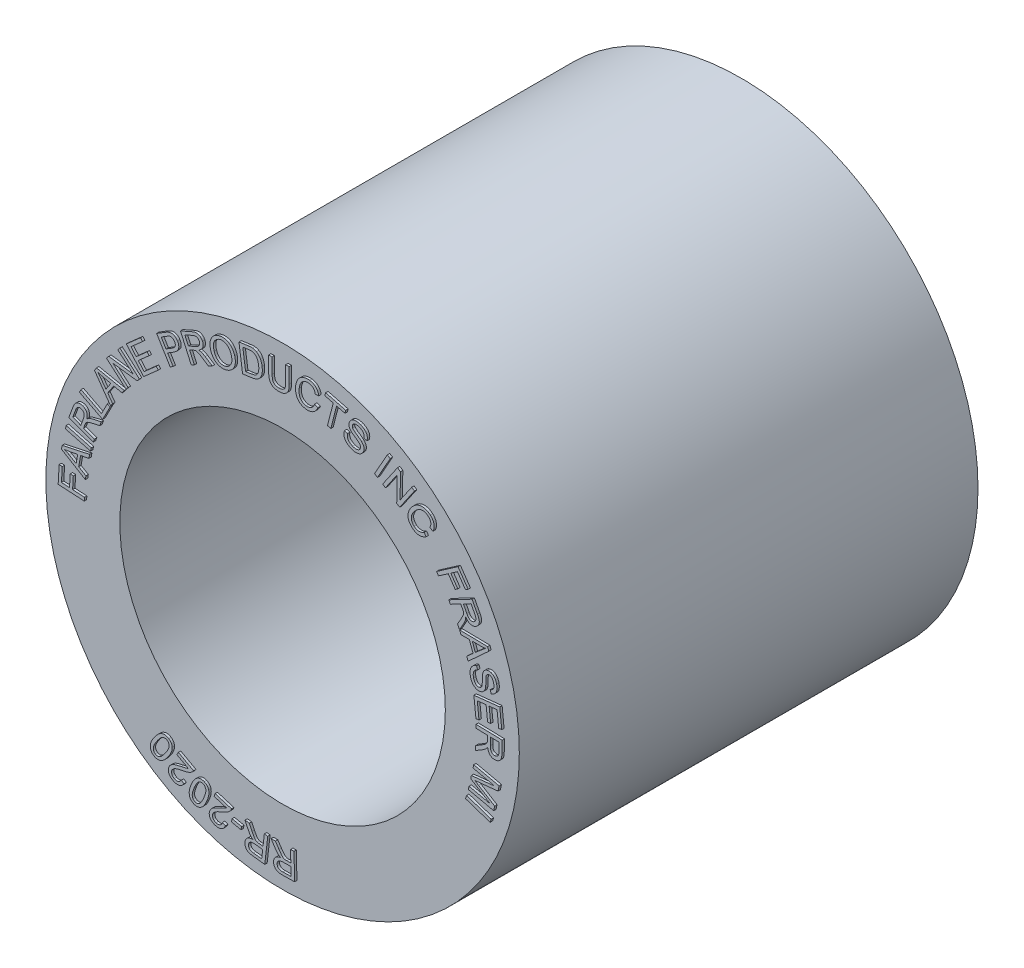
from build123d import *

# Parameters (mm, degrees)
SKETCH1_R          = 25.4
BASE_EXTRUDE_DEPTH = 49.2125
SKETCH2_R          = 17.4625
CUT_EXTRUDE1_DEPTH = 61.927745373
EXTRUDE1_DEPTH     = 0.254
EXTRUDE1_2_DEPTH   = 0.254
EXTRUDE1_3_DEPTH   = 0.254
EXTRUDE1_4_DEPTH   = 0.254
EXTRUDE1_5_DEPTH   = 0.254
EXTRUDE1_6_DEPTH   = 0.254
EXTRUDE1_7_DEPTH   = 0.254
EXTRUDE1_8_DEPTH   = 0.254
EXTRUDE1_9_DEPTH   = 0.254
EXTRUDE1_10_DEPTH  = 0.254
EXTRUDE1_11_DEPTH  = 0.254
EXTRUDE1_12_DEPTH  = 0.254
EXTRUDE1_13_DEPTH  = 0.254
EXTRUDE1_14_DEPTH  = 0.254
EXTRUDE1_15_DEPTH  = 0.254
EXTRUDE1_16_DEPTH  = 0.254
EXTRUDE1_17_DEPTH  = 0.254
EXTRUDE1_18_DEPTH  = 0.254
EXTRUDE1_19_DEPTH  = 0.254
EXTRUDE1_20_DEPTH  = 0.254
EXTRUDE1_21_DEPTH  = 0.254
EXTRUDE1_22_DEPTH  = 0.254
EXTRUDE1_23_DEPTH  = 0.254
EXTRUDE1_24_DEPTH  = 0.254
EXTRUDE1_25_DEPTH  = 0.254
EXTRUDE1_26_DEPTH  = 0.254
EXTRUDE1_27_DEPTH  = 0.254
EXTRUDE1_28_DEPTH  = 0.254
EXTRUDE1_29_DEPTH  = 0.254
EXTRUDE1_30_DEPTH  = 0.254
EXTRUDE1_31_DEPTH  = 0.254
EXTRUDE1_32_DEPTH  = 0.254
EXTRUDE1_33_DEPTH  = 0.254
EXTRUDE1_34_DEPTH  = 0.254


with BuildPart() as part:
    # Sketch1 → Base-Extrude (new body)
    with BuildSketch(Plane.XY):
        Circle(SKETCH1_R)
    extrude(amount=BASE_EXTRUDE_DEPTH)

    # Sketch2 → Cut-Extrude1 (cut, through all)
    with BuildSketch(Plane.XY.offset(49.2125)):
        Circle(SKETCH2_R)
    extrude(amount=-CUT_EXTRUDE1_DEPTH, mode=Mode.SUBTRACT)


with BuildPart() as body_2:
    # Sketch4 → Extrude1 (new body)
    with BuildSketch(Plane(origin=(0, 0, 49.2125), x_dir=(-1, 0, 0), z_dir=(0, 0, -1))):
        Polygon((21.022915183, 0.320934723), (23.823403155, 0.478029402), (23.717275247, 2.367266382), (23.386781601, 2.348366245), (23.471704841, 0.829802021), (22.604568986, 0.781588735), (22.530990926, 2.095819538), (22.20049728, 2.0769194), (22.27407534, 0.762688598), (21.001710515, 0.691607478), align=None)
    extrude(amount=-EXTRUDE1_DEPTH)


with BuildPart() as body_3:
    # Sketch4 → Extrude1 2 (new body)
    with BuildSketch(Plane(origin=(0, 0, 49.2125), x_dir=(-1, 0, 0), z_dir=(0, 0, -1))):
        Polygon((20.906107808, 2.378347663), (23.469019531, 3.919652412), (23.399706639, 4.31133256), (20.452006743, 4.951288825), (20.525384525, 4.536989581), (21.414768726, 4.363073506), (21.617474789, 3.213840671), (20.838209703, 2.764519002), align=None)
        with BuildLine():
            Line((21.895038564, 3.370940217), (21.730204265, 4.303210827))
            Line((21.730204265, 4.303210827), (22.542516419, 4.150489735))
            add(Edge.make_bspline(
                [(22.542516419, 4.150489735), (22.572689775, 4.144810884), (22.631607851, 4.133722064), (22.717861794, 4.11850055), (22.799701183, 4.1042716), (22.877242082, 4.091686881), (22.950616584, 4.080559272), (23.0198305, 4.070917152), (23.084720123, 4.062808855), (23.126563831, 4.058172505), (23.146688361, 4.055942674)],
                knots=[0, 0, 0, 0, 1.204639507, 2.352242182, 3.436465993, 4.463793287, 5.434331818, 6.348209422, 7.205579286, 8, 8, 8, 8], degree=3))
            add(Edge.make_bspline(
                [(23.146688361, 4.055942674), (23.104215293, 4.039086984), (23.018979003, 4.005260455), (22.894277098, 3.946453645), (22.769672184, 3.884893151), (22.688948225, 3.838779981), (22.648301421, 3.815560692)],
                knots=[0, 0, 0, 0, 0.989769628, 1.986300836, 2.986045321, 4, 4, 4, 4], degree=3))
            Line((22.648301421, 3.815560692), (21.895038564, 3.370940217))
        make_face(mode=Mode.SUBTRACT)
    extrude(amount=-EXTRUDE1_2_DEPTH)


with BuildPart() as body_4:
    # Sketch4 → Extrude1 3 (new body)
    with BuildSketch(Plane(origin=(0, 0, 49.2125), x_dir=(-1, 0, 0), z_dir=(0, 0, -1))):
        Polygon((20.355984417, 5.300715672), (23.053171421, 6.026639441), (22.957180742, 6.383237729), (20.259993739, 5.65731396), align=None)
    extrude(amount=-EXTRUDE1_3_DEPTH)


with BuildPart() as body_5:
    # Sketch4 → Extrude1 4 (new body)
    with BuildSketch(Plane(origin=(0, 0, 49.2125), x_dir=(-1, 0, 0), z_dir=(0, 0, -1))):
        with BuildLine():
            Line((20.060546, 6.286089628), (22.678543429, 7.261075515))
            Line((22.678543429, 7.261075515), (22.246241841, 8.422192054))
            add(Edge.make_bspline(
                [(22.246241841, 8.422192054), (22.235513567, 8.450480353), (22.21479962, 8.50509886), (22.181724394, 8.583333156), (22.148547931, 8.655653089), (22.115243957, 8.722094624), (22.081299717, 8.782386539), (22.047251093, 8.836577036), (22.013302203, 8.885123503), (21.978166274, 8.927537819), (21.941896089, 8.965204755), (21.90363634, 8.999265681), (21.862619743, 9.029337233), (21.819132183, 9.056107809), (21.773057771, 9.079205264), (21.723965447, 9.098206006), (21.672816689, 9.114536369), (21.601678829, 9.1308341), (21.510788155, 9.141521788), (21.400907836, 9.140691264), (21.291243229, 9.123374687), (21.22078251, 9.099903711), (21.18508363, 9.088012156)],
                knots=[0, 0, 0, 0, 1.266103904, 2.444569175, 3.553996253, 4.595674594, 5.554111961, 6.44849446, 7.273374811, 8.031471598, 8.751011957, 9.460036684, 10.172525543, 10.87665415, 11.595110831, 12.326124684, 13.077656309, 13.840384552, 15.377341177, 16.895691572, 18.42720403, 20, 20, 20, 20], degree=3))
            add(Edge.make_bspline(
                [(21.18508363, 9.088012156), (21.162412426, 9.078958451), (21.117971535, 9.06121106), (21.055188984, 9.028042988), (20.997581655, 8.990064688), (20.944206625, 8.948097255), (20.896068222, 8.901142761), (20.85277464, 8.849669141), (20.814994186, 8.793109037), (20.780953471, 8.732867262), (20.753184957, 8.667368122), (20.732256092, 8.597313459), (20.717246142, 8.522772212), (20.710701853, 8.443738686), (20.708544514, 8.360269922), (20.714774104, 8.272459487), (20.726808192, 8.180023235), (20.739623778, 8.117506083), (20.746227719, 8.085290653)],
                knots=[0, 0, 0, 0, 0.966861539, 1.895275965, 2.807662155, 3.698009098, 4.581646568, 5.467715391, 6.358062334, 7.273261517, 8.20599948, 9.170343636, 10.166244797, 11.213055347, 12.308768748, 13.471942589, 14.697278172, 16, 16, 16, 16], degree=3))
            add(Edge.make_bspline(
                [(20.746227719, 8.085290653), (20.727579711, 8.103160186), (20.692328207, 8.13694009), (20.638075763, 8.1804407), (20.588738086, 8.217943615), (20.554741584, 8.236871121), (20.538877537, 8.245703408)],
                knots=[0, 0, 0, 0, 1.177834185, 2.22653406, 3.172434046, 4, 4, 4, 4], degree=3))
            add(Edge.make_bspline(
                [(20.538877537, 8.245703408), (20.505056888, 8.261898103), (20.435904157, 8.295011228), (20.325632284, 8.336943284), (20.207275821, 8.373152091), (20.125073338, 8.392902652), (20.082930692, 8.403028148)],
                knots=[0, 0, 0, 0, 0.930315624, 1.90220673, 2.92452688, 4, 4, 4, 4], degree=3))
            Line((20.082930692, 8.403028148), (19.201277981, 8.593487755))
            Line((19.201277981, 8.593487755), (19.363201282, 8.157531218))
            Line((19.363201282, 8.157531218), (20.037256153, 8.014351293))
            add(Edge.make_bspline(
                [(20.037256153, 8.014351293), (20.083217504, 8.004105714), (20.169998667, 7.984760694), (20.291464732, 7.95450782), (20.396795016, 7.926609896), (20.486888647, 7.899990736), (20.563809172, 7.873565898), (20.629445657, 7.84647248), (20.68490633, 7.818799676), (20.743406214, 7.780454298), (20.804281134, 7.728624671), (20.841800977, 7.679546668), (20.860062838, 7.655659158)],
                knots=[0, 0, 0, 0, 1.537119346, 2.902286429, 4.085938258, 5.093835562, 5.968414648, 6.739529676, 7.410789899, 7.987681804, 9.020553658, 10, 10, 10, 10], degree=3))
            add(Edge.make_bspline(
                [(20.860062838, 7.655659158), (20.866210098, 7.644979952), (20.880142775, 7.620775683), (20.900605328, 7.578661534), (20.922002142, 7.526384458), (20.936704323, 7.488253685), (20.944624768, 7.467711651)],
                knots=[0, 0, 0, 0, 0.716367316, 1.623636251, 2.719791395, 4, 4, 4, 4], degree=3))
            Line((20.944624768, 7.467711651), (21.094144853, 7.06516294))
            Line((21.094144853, 7.06516294), (19.931373501, 6.632179865))
            Line((19.931373501, 6.632179865), (20.060546, 6.286089628))
        make_face()
        with BuildLine():
            Line((21.394017054, 7.176850256), (21.116687444, 7.922179577))
            add(Edge.make_bspline(
                [(21.116687444, 7.922179577), (21.103233121, 7.959722111), (21.077819323, 8.030636002), (21.050394404, 8.133753419), (21.032672307, 8.226144175), (21.025882385, 8.309138205), (21.029991812, 8.384324745), (21.045715296, 8.453317706), (21.071251682, 8.517144322), (21.106914968, 8.574942773), (21.151155587, 8.625206615), (21.200648979, 8.669326618), (21.256692817, 8.704929331), (21.297384627, 8.72215695), (21.317858386, 8.73082489)],
                knots=[0, 0, 0, 0, 1.517942905, 2.86723422, 4.058521457, 5.095774034, 6.0304028, 6.913950759, 7.778132227, 8.63686328, 9.486108639, 10.319376806, 11.15440785, 12, 12, 12, 12], degree=3))
            add(Edge.make_bspline(
                [(21.317858386, 8.73082489), (21.33324545, 8.735991706), (21.363282167, 8.746077723), (21.409130284, 8.756272), (21.454580117, 8.760854295), (21.49965443, 8.761003147), (21.544189505, 8.75551618), (21.588200109, 8.74564005), (21.631464791, 8.730052495), (21.674300858, 8.710210035), (21.716221603, 8.68458473), (21.75588392, 8.652196317), (21.793435538, 8.613444601), (21.829763022, 8.569148537), (21.862943234, 8.517645064), (21.895085829, 8.460446415), (21.925317372, 8.397034804), (21.942732984, 8.351846888), (21.951703216, 8.328572019)],
                knots=[0, 0, 0, 0, 0.91669321, 1.789454742, 2.646917881, 3.493178844, 4.3306008, 5.176928881, 6.036244851, 6.923657229, 7.840536312, 8.804350253, 9.808288435, 10.885272001, 12.035452372, 13.264558459, 14.591060416, 16, 16, 16, 16], degree=3))
            Line((21.951703216, 8.328572019), (22.260225831, 7.499508988))
            Line((22.260225831, 7.499508988), (21.394017054, 7.176850256))
        make_face(mode=Mode.SUBTRACT)
    extrude(amount=-EXTRUDE1_4_DEPTH)


with BuildPart() as body_6:
    # Sketch4 → Extrude1 5 (new body)
    with BuildSketch(Plane(origin=(0, 0, 49.2125), x_dir=(-1, 0, 0), z_dir=(0, 0, -1))):
        Polygon((19.052003112, 8.898530448), (21.540105557, 10.179260549), (21.370599055, 10.508485021), (19.176251863, 9.37879231), (18.545482735, 10.604154809), (18.251727482, 10.453117419), align=None)
    extrude(amount=-EXTRUDE1_5_DEPTH)


with BuildPart() as body_7:
    # Sketch4 → Extrude1 6 (new body)
    with BuildSketch(Plane(origin=(0, 0, 49.2125), x_dir=(-1, 0, 0), z_dir=(0, 0, -1))):
        Polygon((18.193461511, 10.570277412), (19.927737919, 13.023819752), (19.70545857, 13.356301089), (16.735253794, 12.752284789), (16.970008004, 12.401143785), (17.858180578, 12.601073049), (18.509752921, 11.625898359), (17.974584398, 10.897669749), align=None)
        with BuildLine():
            Line((18.701532488, 11.882690955), (18.173268984, 12.673704983))
            Line((18.173268984, 12.673704983), (18.981833899, 12.861950791))
            add(Edge.make_bspline(
                [(18.981833899, 12.861950791), (19.011906092, 12.868763197), (19.070534787, 12.882044651), (19.155917944, 12.903490111), (19.237018278, 12.923202333), (19.313458009, 12.943475316), (19.38567156, 12.961922661), (19.453114268, 12.981680194), (19.51651869, 12.999500925), (19.556942271, 13.012605393), (19.576428579, 13.018922441)],
                knots=[0, 0, 0, 0, 1.20296225, 2.345293148, 3.434609861, 4.459142521, 5.430700967, 6.342222442, 7.200863399, 8, 8, 8, 8], degree=3))
            add(Edge.make_bspline(
                [(19.576428579, 13.018922441), (19.544204318, 12.986089527), (19.47967162, 12.920337932), (19.387948065, 12.816297251), (19.298529639, 12.70901558), (19.243036159, 12.633751643), (19.215171362, 12.595959559)],
                knots=[0, 0, 0, 0, 0.99128383, 1.985157124, 2.988292195, 4, 4, 4, 4], degree=3))
            Line((19.215171362, 12.595959559), (18.701532488, 11.882690955))
        make_face(mode=Mode.SUBTRACT)
    extrude(amount=-EXTRUDE1_6_DEPTH)


with BuildPart() as body_8:
    # Sketch4 → Extrude1 7 (new body)
    with BuildSketch(Plane(origin=(0, 0, 49.2125), x_dir=(-1, 0, 0), z_dir=(0, 0, -1))):
        Polygon((16.547695043, 12.9661622), (18.645698418, 14.800031013), (18.396675218, 15.08525249), (15.786157873, 14.747360895), (17.43357154, 16.187376461), (17.201323281, 16.453178788), (15.103319906, 14.619309975), (15.351858709, 14.334725621), (17.9636503, 14.67358601), (16.314962387, 13.23260165), align=None)
    extrude(amount=-EXTRUDE1_7_DEPTH)


with BuildPart() as body_9:
    # Sketch4 → Extrude1 8 (new body)
    with BuildSketch(Plane(origin=(0, 0, 49.2125), x_dir=(-1, 0, 0), z_dir=(0, 0, -1))):
        Polygon((14.654122701, 15.074759135), (16.510817803, 17.176570754), (14.991398152, 18.518954562), (14.772284672, 18.270659623), (16.013898024, 17.173968873), (15.445019867, 16.530099507), (14.282128934, 17.557245063), (14.064492488, 17.310843128), (15.227383421, 16.283697572), (14.595429882, 15.568747132), (13.305167145, 16.708472826), (13.086053664, 16.460177886), align=None)
    extrude(amount=-EXTRUDE1_8_DEPTH)


with BuildPart() as body_10:
    # Sketch4 → Extrude1 9 (new body)
    with BuildSketch(Plane(origin=(0, 0, 49.2125), x_dir=(-1, 0, 0), z_dir=(0, 0, -1))):
        with BuildLine():
            Line((11.804045106, 17.397933907), (13.261595462, 19.782498514))
            Line((13.261595462, 19.782498514), (12.361877506, 20.332217882))
            add(Edge.make_bspline(
                [(12.361877506, 20.332217882), (12.342558477, 20.343977829), (12.30526929, 20.366676633), (12.250357297, 20.398639472), (12.198867401, 20.427933081), (12.15008806, 20.453894057), (12.105176382, 20.47807523), (12.062533508, 20.49827528), (12.023349019, 20.516224542), (11.997782555, 20.52627986), (11.985707798, 20.531028875)],
                knots=[0, 0, 0, 0, 1.274160249, 2.459357664, 3.579487266, 4.611276563, 5.572505842, 6.452512066, 7.269138649, 8, 8, 8, 8], degree=3))
            add(Edge.make_bspline(
                [(11.985707798, 20.531028875), (11.954087991, 20.542944102), (11.892783306, 20.566045422), (11.799671079, 20.588422342), (11.709911005, 20.601171198), (11.622568213, 20.601495822), (11.537297944, 20.590689051), (11.453218162, 20.568158584), (11.370498548, 20.532654185), (11.289027241, 20.487253178), (11.211398891, 20.431080486), (11.140444247, 20.364530612), (11.074646062, 20.290149127), (11.038370122, 20.233877226), (11.019959136, 20.205317768)],
                knots=[0, 0, 0, 0, 1.085066523, 2.103733955, 3.070809273, 3.992797861, 4.901877952, 5.825857878, 6.780518953, 7.787627462, 8.818330595, 9.851029008, 10.909341141, 12, 12, 12, 12], degree=3))
            add(Edge.make_bspline(
                [(11.019959136, 20.205317768), (11.005264397, 20.180012313), (10.976403768, 20.130312119), (10.941432981, 20.052752269), (10.914333042, 19.974476687), (10.895805329, 19.895173123), (10.884274677, 19.815374744), (10.880683432, 19.734772971), (10.885756773, 19.65341467), (10.897411946, 19.571125962), (10.920005932, 19.487942111), (10.958475468, 19.406470856), (11.009196306, 19.325017969), (11.074671631, 19.245084794), (11.153496006, 19.165583794), (11.246168555, 19.086718537), (11.352473988, 19.008597254), (11.429771451, 18.959700702), (11.469843274, 18.934352211)],
                knots=[0, 0, 0, 0, 0.911880679, 1.790943729, 2.647847319, 3.490584891, 4.326107994, 5.158499262, 6.001134206, 6.864152292, 7.746573592, 8.676783099, 9.662461174, 10.731770425, 11.890690843, 13.148934111, 14.521977243, 16, 16, 16, 16], degree=3))
            Line((11.469843274, 18.934352211), (12.080955309, 18.560313035))
            Line((12.080955309, 18.560313035), (11.488177227, 17.590793841))
            Line((11.488177227, 17.590793841), (11.804045106, 17.397933907))
        make_face()
        with BuildLine():
            Line((12.25266022, 18.841790421), (11.636201783, 19.218811058))
            add(Edge.make_bspline(
                [(11.636201783, 19.218811058), (11.611903619, 19.234158124), (11.565060972, 19.263744606), (11.500163679, 19.310737667), (11.442753457, 19.357682939), (11.392753282, 19.404569846), (11.350835548, 19.452311684), (11.316540631, 19.500139089), (11.289649632, 19.548077873), (11.270670657, 19.596482273), (11.258439189, 19.645120204), (11.252634927, 19.694385576), (11.252563748, 19.743928125), (11.258729635, 19.793914844), (11.26973972, 19.844429477), (11.28712108, 19.895200145), (11.310434018, 19.946371261), (11.329636089, 19.979479976), (11.339536647, 19.996550777)],
                knots=[0, 0, 0, 0, 1.445584768, 2.786836666, 4.028055666, 5.174667708, 6.231212213, 7.219068997, 8.130623747, 8.989049558, 9.827033094, 10.646814552, 11.478756934, 12.313185797, 13.17595518, 14.075323819, 15.007640012, 16, 16, 16, 16], degree=3))
            add(Edge.make_bspline(
                [(11.339536647, 19.996550777), (11.355060005, 20.020032149), (11.385383135, 20.065900365), (11.441365944, 20.124174848), (11.502661165, 20.172588224), (11.57010211, 20.207952092), (11.640572953, 20.232546051), (11.712677038, 20.243599199), (11.785510834, 20.242802485), (11.832482522, 20.231277885), (11.856270585, 20.225441435)],
                knots=[0, 0, 0, 0, 1.107652679, 2.163674759, 3.170062854, 4.17411278, 5.151140446, 6.098860933, 7.037198399, 8, 8, 8, 8], degree=3))
            add(Edge.make_bspline(
                [(11.856270585, 20.225441435), (11.86458885, 20.222543645), (11.882627733, 20.216259536), (11.91163073, 20.204784552), (11.944386279, 20.190098555), (11.980773922, 20.171352129), (12.020867614, 20.149450519), (12.065510289, 20.125289211), (12.113410677, 20.097076945), (12.146477962, 20.076906247), (12.163685736, 20.066409685)],
                knots=[0, 0, 0, 0, 0.609534123, 1.321827972, 2.157742177, 3.092596164, 4.153573698, 5.319476509, 6.605091318, 8, 8, 8, 8], degree=3))
            Line((12.163685736, 20.066409685), (12.773519154, 19.693622696))
            Line((12.773519154, 19.693622696), (12.25266022, 18.841790421))
        make_face(mode=Mode.SUBTRACT)
    extrude(amount=-EXTRUDE1_9_DEPTH)


with BuildPart() as body_11:
    # Sketch4 → Extrude1 10 (new body)
    with BuildSketch(Plane(origin=(0, 0, 49.2125), x_dir=(-1, 0, 0), z_dir=(0, 0, -1))):
        with BuildLine():
            Line((9.554010906, 18.725817711), (10.698812113, 21.29136528))
            Line((10.698812113, 21.29136528), (9.56127437, 21.799131291))
            add(Edge.make_bspline(
                [(9.56127437, 21.799131291), (9.53356163, 21.811403257), (9.479771679, 21.835222932), (9.399876199, 21.86594786), (9.324576534, 21.893304907), (9.25355053, 21.916826918), (9.186435612, 21.934544577), (9.123738448, 21.948729585), (9.065047645, 21.957820175), (9.009887824, 21.963182295), (8.957132263, 21.963243038), (8.90568321, 21.960349671), (8.855096273, 21.9520642), (8.805329048, 21.939263831), (8.756192881, 21.922774959), (8.707897275, 21.901305257), (8.660236748, 21.875997731), (8.598476145, 21.836436245), (8.526291547, 21.779315277), (8.450013816, 21.69920231), (8.384928431, 21.608259305), (8.352095028, 21.540960949), (8.335478348, 21.506901877)],
                knots=[0, 0, 0, 0, 1.260602524, 2.446807768, 3.55975728, 4.593472737, 5.55771453, 6.44624076, 7.266172872, 8.0268859, 8.749018025, 9.458633764, 10.168249503, 10.877300936, 11.594469894, 12.321573654, 13.073370098, 13.837112821, 15.370252175, 16.889369325, 18.425738731, 20, 20, 20, 20], degree=3))
            add(Edge.make_bspline(
                [(8.335478348, 21.506901877), (8.326132452, 21.48427981), (8.307764659, 21.439819926), (8.287218883, 21.371571803), (8.273611956, 21.303591851), (8.266163773, 21.23582465), (8.265891049, 21.168182081), (8.272116041, 21.100621121), (8.286409007, 21.033549826), (8.305715277, 20.966440736), (8.333013541, 20.900453854), (8.36901275, 20.836234249), (8.411627435, 20.772967497), (8.46405504, 20.71254221), (8.522613325, 20.652680288), (8.590318161, 20.59541545), (8.664984492, 20.53889739), (8.719097958, 20.504161273), (8.746831416, 20.486358816)],
                knots=[0, 0, 0, 0, 0.963964552, 1.894510858, 2.802794726, 3.692271762, 4.576234976, 5.463722267, 6.359882077, 7.274137473, 8.212104969, 9.165871599, 10.170802415, 11.211808563, 12.313081602, 13.467333788, 14.701994215, 16, 16, 16, 16], degree=3))
            add(Edge.make_bspline(
                [(8.746831416, 20.486358816), (8.720960523, 20.485151888), (8.671756649, 20.482856433), (8.601948418, 20.476158152), (8.54035897, 20.465356957), (8.502750128, 20.454741122), (8.485203658, 20.449788286)],
                knots=[0, 0, 0, 0, 1.17294928, 2.230833342, 3.174592279, 4, 4, 4, 4], degree=3))
            add(Edge.make_bspline(
                [(8.485203658, 20.449788286), (8.449843491, 20.436893694), (8.377307962, 20.410442573), (8.269496839, 20.360863514), (8.15970899, 20.302029754), (8.087799028, 20.256835481), (8.050917653, 20.233656121)],
                knots=[0, 0, 0, 0, 0.928485551, 1.904634417, 2.925323272, 4, 4, 4, 4], degree=3))
            Line((8.050917653, 20.233656121), (7.293023704, 19.734989588))
            Line((7.293023704, 19.734989588), (7.720089239, 19.544350946))
            Line((7.720089239, 19.544350946), (8.297874229, 19.926769026))
            add(Edge.make_bspline(
                [(8.297874229, 19.926769026), (8.337640623, 19.952542518), (8.412620696, 20.001138785), (8.519212487, 20.067903839), (8.613951898, 20.122897167), (8.696214949, 20.169186109), (8.769270079, 20.205971526), (8.834944025, 20.233666197), (8.893646773, 20.254931955), (8.962720523, 20.269157687), (9.042748176, 20.276382494), (9.104306977, 20.268430283), (9.134168767, 20.264572715)],
                knots=[0, 0, 0, 0, 1.538877391, 2.90157407, 4.083777112, 5.095769725, 5.966715192, 6.737761708, 7.410225799, 7.989220037, 9.024583151, 10, 10, 10, 10], degree=3))
            add(Edge.make_bspline(
                [(9.134168767, 20.264572715), (9.146203328, 20.261559853), (9.1735663, 20.254709512), (9.218113381, 20.239015043), (9.271128686, 20.218133987), (9.308795581, 20.201468522), (9.329101044, 20.192484506)],
                knots=[0, 0, 0, 0, 0.714951929, 1.625585628, 2.720001102, 4, 4, 4, 4], degree=3))
            Line((9.329101044, 20.192484506), (9.722901392, 20.01684067))
            Line((9.722901392, 20.01684067), (9.214629438, 18.877326136))
            Line((9.214629438, 18.877326136), (9.554010906, 18.725817711))
        make_face()
        with BuildLine():
            Line((9.854360031, 20.310802924), (9.12471092, 20.636564955))
            add(Edge.make_bspline(
                [(9.12471092, 20.636564955), (9.088270574, 20.653520016), (9.019315658, 20.685603541), (8.925497182, 20.737977428), (8.846766435, 20.790595082), (8.782394014, 20.843969579), (8.731294835, 20.899945755), (8.693125375, 20.959819907), (8.665250143, 21.022952523), (8.649433207, 21.089295086), (8.643900484, 21.156763046), (8.647765821, 21.223342401), (8.661176417, 21.288788888), (8.677528085, 21.329908993), (8.685836273, 21.350801884)],
                knots=[0, 0, 0, 0, 1.5205565, 2.877300955, 4.061569727, 5.099407738, 6.034575373, 6.917120024, 7.774951088, 8.634117761, 9.485059702, 10.328059425, 11.150496576, 12, 12, 12, 12], degree=3))
            add(Edge.make_bspline(
                [(8.685836273, 21.350801884), (8.692663675, 21.365575583), (8.706065489, 21.39457554), (8.732067871, 21.434162255), (8.7602214, 21.470464264), (8.791777566, 21.503013024), (8.827394664, 21.530617229), (8.865482585, 21.555328927), (8.90715341, 21.575560373), (8.951638185, 21.592212748), (8.999584091, 21.603713268), (9.050718523, 21.609925493), (9.105039692, 21.60954001), (9.162349622, 21.603377626), (9.222928542, 21.592202703), (9.286448866, 21.574413609), (9.353118457, 21.551282668), (9.397684477, 21.532027628), (9.42069736, 21.522084761)],
                knots=[0, 0, 0, 0, 0.913278594, 1.792715582, 2.653559906, 3.492593775, 4.331627644, 5.180247739, 6.039262979, 6.928924476, 7.844230601, 8.802882526, 9.816061362, 10.889123925, 12.038177261, 13.273050052, 14.591864821, 16, 16, 16, 16], degree=3))
            Line((9.42069736, 21.522084761), (10.23294192, 21.159467031))
            Line((10.23294192, 21.159467031), (9.854360031, 20.310802924))
        make_face(mode=Mode.SUBTRACT)
    extrude(amount=-EXTRUDE1_10_DEPTH)


with BuildPart() as body_12:
    # Sketch4 → Extrude1 11 (new body)
    with BuildSketch(Plane(origin=(0, 0, 49.2125), x_dir=(-1, 0, 0), z_dir=(0, 0, -1))):
        with BuildLine():
            add(Edge.make_bspline(
                [(7.451932257, 21.115739442), (7.466596904, 21.170570797), (7.495125077, 21.277238099), (7.522176947, 21.436775377), (7.536292845, 21.590258111), (7.5371263, 21.738178864), (7.522697981, 21.880225925), (7.494387713, 22.016275211), (7.452816136, 22.146833517), (7.39661025, 22.270349961), (7.329035119, 22.386177284), (7.251200935, 22.492898795), (7.162787196, 22.58924003), (7.064463778, 22.67566196), (6.956102987, 22.752091159), (6.838013518, 22.818564172), (6.709905142, 22.874797852), (6.6195572, 22.903215267), (6.573440213, 22.917720584)],
                knots=[0, 0, 0, 0, 1.204502832, 2.343204331, 3.430452443, 4.473976474, 5.478615167, 6.455872679, 7.419443315, 8.381414469, 9.330889835, 10.262043652, 11.180273666, 12.101433876, 13.036078232, 13.990314381, 14.974180918, 16, 16, 16, 16], degree=3))
            add(Edge.make_bspline(
                [(6.573440213, 22.917720584), (6.542429709, 22.926031863), (6.481295519, 22.942416741), (6.388753062, 22.95988398), (6.297117063, 22.971182374), (6.205967177, 22.977060868), (6.115540365, 22.975223847), (6.025743303, 22.968076296), (5.936883582, 22.954016438), (5.848919672, 22.934424612), (5.762991784, 22.908405759), (5.679643694, 22.877245336), (5.599897893, 22.839599898), (5.522774687, 22.797275452), (5.449550267, 22.747802443), (5.378486104, 22.694067452), (5.311567063, 22.633542831), (5.247764908, 22.567999916), (5.187762234, 22.497602989), (5.131665729, 22.423020804), (5.079687824, 22.344294212), (5.031897258, 22.261415178), (4.987899556, 22.174517152), (4.9493084, 22.083154096), (4.913462974, 21.988226593), (4.893522902, 21.92279388), (4.883410312, 21.889609738)],
                knots=[0, 0, 0, 0, 1.039408331, 2.049092307, 3.046672243, 4.028128423, 5.004150827, 5.973054138, 6.943150799, 7.915111535, 8.889220168, 9.848367611, 10.793916664, 11.742716424, 12.694246039, 13.653082147, 14.625657052, 15.6129897, 16.613464832, 17.619000419, 18.633404637, 19.666492238, 20.715710487, 21.785378039, 22.876856464, 24, 24, 24, 24], degree=3))
            add(Edge.make_bspline(
                [(4.883410312, 21.889609738), (4.874115278, 21.855646531), (4.855771939, 21.788621642), (4.83581932, 21.687493916), (4.820465475, 21.588006739), (4.811839006, 21.489565714), (4.809059819, 21.392279516), (4.812061648, 21.296056873), (4.821795217, 21.201135261), (4.836386145, 21.107712086), (4.857192084, 21.016995023), (4.883841962, 20.929536574), (4.916131013, 20.845805555), (4.954285278, 20.765616788), (4.998130741, 20.689171806), (5.048030885, 20.6164674), (5.103029416, 20.54704369), (5.164313162, 20.482344318), (5.229331724, 20.421621446), (5.297788779, 20.365337854), (5.36922386, 20.313787175), (5.443831417, 20.267362611), (5.521007797, 20.224515509), (5.601838185, 20.187848695), (5.685055329, 20.154371014), (5.742492217, 20.137107234), (5.771426526, 20.128410462)],
                knots=[0, 0, 0, 0, 1.143351095, 2.256352919, 3.345728099, 4.411692602, 5.463599736, 6.505339466, 7.536065154, 8.560909804, 9.574742021, 10.556364113, 11.528145903, 12.486819873, 13.437984582, 14.387371449, 15.348548488, 16.31159856, 17.278946725, 18.236543147, 19.188240562, 20.137963498, 21.089286078, 22.052959684, 23.019162265, 24, 24, 24, 24], degree=3))
            add(Edge.make_bspline(
                [(5.771426526, 20.128410462), (5.803019255, 20.119974687), (5.865317063, 20.103340154), (5.959470076, 20.085240283), (6.052643851, 20.074400499), (6.14493668, 20.069428484), (6.236355652, 20.071072221), (6.326840738, 20.07916405), (6.416589884, 20.093411874), (6.504902793, 20.114638297), (6.591218821, 20.141902804), (6.674697604, 20.174333972), (6.754367461, 20.213237913), (6.831310629, 20.256309032), (6.904220901, 20.306117727), (6.974810504, 20.360164196), (7.041063241, 20.420902264), (7.104195283, 20.486167508), (7.162677159, 20.5560444), (7.218287636, 20.627900369), (7.268449815, 20.703099264), (7.314364034, 20.780462248), (7.355690122, 20.860472587), (7.392826846, 20.942958794), (7.42483305, 21.028292307), (7.442884156, 21.08654189), (7.451932257, 21.115739442)],
                knots=[0, 0, 0, 0, 1.078752694, 2.127196053, 3.160207556, 4.171690097, 5.174787067, 6.174479107, 7.167014005, 8.170593692, 9.168481845, 10.151997077, 11.122584323, 12.091813322, 13.058801047, 14.033610682, 15.022880558, 16.021506177, 17.027688538, 18.028000518, 19.018209946, 20.008243276, 20.995062203, 21.988045934, 22.99150979, 24, 24, 24, 24], degree=3))
        make_face()
        with BuildLine():
            add(Edge.make_bspline(
                [(7.082451923, 21.215677141), (7.070305842, 21.176264823), (7.046655318, 21.099522208), (7.001756431, 20.990679423), (6.950836213, 20.890566019), (6.893024641, 20.799341381), (6.829338078, 20.716703335), (6.759726507, 20.642338444), (6.682731063, 20.577964597), (6.6006599, 20.52211664), (6.514351377, 20.476185922), (6.425792392, 20.439629871), (6.335429587, 20.412866826), (6.243306177, 20.396989505), (6.149813371, 20.390075037), (6.054741222, 20.394314896), (5.957853334, 20.407638346), (5.893859423, 20.424279876), (5.861272744, 20.432753997)],
                knots=[0, 0, 0, 0, 1.213465116, 2.362826933, 3.460831729, 4.515914622, 5.537015896, 6.528034218, 7.507944399, 8.485049924, 9.445187592, 10.380549317, 11.301006772, 12.213185898, 13.127289846, 14.055054885, 15.009604177, 16, 16, 16, 16], degree=3))
            add(Edge.make_bspline(
                [(5.861272744, 20.432753997), (5.828718215, 20.443076117), (5.764714739, 20.463369807), (5.673752092, 20.503519939), (5.590079199, 20.551876684), (5.513673436, 20.607850739), (5.44399013, 20.671029151), (5.381008088, 20.741729156), (5.326239144, 20.82089677), (5.277959969, 20.90630598), (5.238785576, 20.998382349), (5.209554353, 21.096144414), (5.189782754, 21.198902707), (5.182315741, 21.306763567), (5.183629194, 21.41948959), (5.195559031, 21.537412589), (5.217800532, 21.660414685), (5.240045246, 21.742939545), (5.251445914, 21.785234473)],
                knots=[0, 0, 0, 0, 0.97936682, 1.925473451, 2.846188617, 3.747025032, 4.637805055, 5.540412134, 6.457237162, 7.394617851, 8.351072158, 9.321559294, 10.317389707, 11.346894389, 12.418124656, 13.548542289, 14.743600072, 16, 16, 16, 16], degree=3))
            add(Edge.make_bspline(
                [(5.251445914, 21.785234473), (5.259572466, 21.81213129), (5.275576642, 21.865101034), (5.303094634, 21.942291156), (5.333692851, 22.0156386), (5.367313213, 22.085326948), (5.403308462, 22.151260691), (5.44162345, 22.214000457), (5.483282384, 22.272617518), (5.527126385, 22.328185578), (5.573989757, 22.379301668), (5.622688413, 22.426599741), (5.674152234, 22.468751836), (5.727503855, 22.506952291), (5.782895673, 22.54124653), (5.840838555, 22.570643447), (5.901223844, 22.594946965), (5.963167239, 22.6154844), (6.02654806, 22.631078049), (6.09044897, 22.642686174), (6.154950615, 22.649048688), (6.219783731, 22.651320838), (6.285248849, 22.648697829), (6.350936667, 22.640392199), (6.417262511, 22.628890637), (6.460860289, 22.617107335), (6.482871629, 22.611158265)],
                knots=[0, 0, 0, 0, 1.211916326, 2.386709897, 3.53320478, 4.638529927, 5.72277571, 6.772546838, 7.807580038, 8.823042943, 9.823825107, 10.796828431, 11.748952599, 12.690410822, 13.625694325, 14.556542237, 15.489273415, 16.431153564, 17.369229545, 18.302528509, 19.230348107, 20.162475633, 21.099138741, 22.052861192, 23.016942239, 24, 24, 24, 24], degree=3))
            add(Edge.make_bspline(
                [(6.482871629, 22.611158265), (6.513782813, 22.601400682), (6.57452932, 22.582225129), (6.661242595, 22.543814842), (6.742190686, 22.498509274), (6.81787338, 22.445994244), (6.886855998, 22.385620534), (6.951074995, 22.318675001), (7.008701768, 22.244051666), (7.061680843, 22.163129327), (7.106248697, 22.074043313), (7.137608735, 21.975488403), (7.158328899, 21.86901087), (7.166345831, 21.754187611), (7.162815027, 21.631163691), (7.147579024, 21.499766535), (7.121517784, 21.359736566), (7.095775631, 21.2648097), (7.082451923, 21.215677141)],
                knots=[0, 0, 0, 0, 0.902902247, 1.774379086, 2.637696806, 3.485259966, 4.336728218, 5.188585994, 6.066793705, 6.960633389, 7.88136318, 8.833271914, 9.833942027, 10.898179123, 12.034368046, 13.25958959, 14.581609381, 16, 16, 16, 16], degree=3))
        make_face(mode=Mode.SUBTRACT)
    extrude(amount=-EXTRUDE1_11_DEPTH)


with BuildPart() as body_13:
    # Sketch4 → Extrude1 12 (new body)
    with BuildSketch(Plane(origin=(0, 0, 49.2125), x_dir=(-1, 0, 0), z_dir=(0, 0, -1))):
        with BuildLine():
            Line((4.034262617, 20.632312308), (4.428430174, 23.405929695))
            Line((4.428430174, 23.405929695), (3.472676762, 23.541413613))
            add(Edge.make_bspline(
                [(3.472676762, 23.541413613), (3.446459268, 23.545237782), (3.395810732, 23.552625543), (3.321832258, 23.560393951), (3.252557892, 23.567994358), (3.187746102, 23.57222715), (3.127515848, 23.575882644), (3.072031685, 23.576201285), (3.021015407, 23.576232188), (2.988703135, 23.573611807), (2.97329109, 23.572361958)],
                knots=[0, 0, 0, 0, 1.268250057, 2.450081972, 3.560759834, 4.604037026, 5.55915808, 6.448663658, 7.26005618, 8, 8, 8, 8], degree=3))
            add(Edge.make_bspline(
                [(2.97329109, 23.572361958), (2.933236854, 23.567717614), (2.854673139, 23.558608042), (2.741406691, 23.529299672), (2.635078913, 23.488121368), (2.570282343, 23.450406791), (2.538074706, 23.431660468)],
                knots=[0, 0, 0, 0, 1.047058062, 2.053734599, 3.032593697, 4, 4, 4, 4], degree=3))
            add(Edge.make_bspline(
                [(2.538074706, 23.431660468), (2.517892272, 23.418463817), (2.477585582, 23.392108558), (2.420639498, 23.347555268), (2.366779499, 23.299464884), (2.315582662, 23.247888796), (2.267947515, 23.192220935), (2.223183582, 23.132863676), (2.180634801, 23.070413231), (2.142436031, 23.003499922), (2.10612743, 22.933866251), (2.073627788, 22.86078777), (2.043306473, 22.785064732), (2.01647915, 22.706100792), (1.992991507, 22.623856454), (1.971852036, 22.538771118), (1.954014572, 22.450552912), (1.944971606, 22.390524016), (1.940384135, 22.360071522)],
                knots=[0, 0, 0, 0, 0.913054446, 1.823476879, 2.735412248, 3.646703525, 4.573962879, 5.508161724, 6.461752714, 7.433981734, 8.424730075, 9.435250689, 10.461936649, 11.513509474, 12.592473902, 13.700849654, 14.833647319, 16, 16, 16, 16], degree=3))
            add(Edge.make_bspline(
                [(1.940384135, 22.360071522), (1.933920864, 22.30879531), (1.921344663, 22.209022288), (1.914346991, 22.062119829), (1.918409144, 21.922843219), (1.931996598, 21.791610675), (1.95545841, 21.669643926), (1.984668885, 21.556816694), (2.020604829, 21.453442969), (2.064119128, 21.360014863), (2.112755547, 21.275595516), (2.164764357, 21.198896911), (2.221259094, 21.130406575), (2.282456616, 21.069671508), (2.349733809, 21.015764479), (2.423778591, 20.966531351), (2.505986669, 20.922571067), (2.595996326, 20.88303246), (2.693990168, 20.848783008), (2.799623145, 20.818137615), (2.913570533, 20.793166494), (2.992569352, 20.780757186), (3.033282462, 20.774361881)],
                knots=[0, 0, 0, 0, 1.405940452, 2.735672634, 3.997035745, 5.194298369, 6.321470047, 7.373479859, 8.363446546, 9.29495294, 10.173468911, 11.01211849, 11.813706763, 12.585535683, 13.353943056, 14.155942126, 15.001693861, 15.887379071, 16.828454061, 17.824298964, 18.878723066, 20, 20, 20, 20], degree=3))
            Line((3.033282462, 20.774361881), (4.034262617, 20.632312308))
        make_face()
        with BuildLine():
            Line((3.713691838, 21.011620193), (3.121153592, 21.095352733))
            add(Edge.make_bspline(
                [(3.121153592, 21.095352733), (3.078028752, 21.102218394), (2.996644437, 21.115175131), (2.882687179, 21.140242045), (2.784519995, 21.170741606), (2.700271023, 21.204866161), (2.629187254, 21.245226197), (2.566673997, 21.287251372), (2.513249677, 21.334536791), (2.48404508, 21.37008663), (2.469746666, 21.387491641)],
                knots=[0, 0, 0, 0, 1.43103435, 2.700618718, 3.819926481, 4.796939327, 5.672763569, 6.493897892, 7.262620511, 8, 8, 8, 8], degree=3))
            add(Edge.make_bspline(
                [(2.469746666, 21.387491641), (2.451699918, 21.413611561), (2.414858595, 21.466933767), (2.372983924, 21.558120135), (2.338545159, 21.658392718), (2.314232992, 21.769344538), (2.299012604, 21.890566614), (2.294149033, 22.022161545), (2.301247543, 22.164113484), (2.313187942, 22.261456296), (2.319389269, 22.312011936)],
                knots=[0, 0, 0, 0, 0.79234968, 1.61753303, 2.498014809, 3.439328239, 4.45116044, 5.54877171, 6.726938207, 8, 8, 8, 8], degree=3))
            add(Edge.make_bspline(
                [(2.319389269, 22.312011936), (2.324870811, 22.347110165), (2.335519108, 22.415291036), (2.356132929, 22.513914984), (2.380774123, 22.60552324), (2.408616415, 22.690325885), (2.439612711, 22.768241395), (2.47465394, 22.839151926), (2.513654803, 22.902986176), (2.556134878, 22.959962217), (2.601152975, 23.010506535), (2.646636647, 23.056704232), (2.694042836, 23.097423899), (2.742214703, 23.133529135), (2.792246226, 23.163772309), (2.84306853, 23.189102901), (2.895142585, 23.210048024), (2.930984673, 23.219514832), (2.948863418, 23.224237064)],
                knots=[0, 0, 0, 0, 1.445717274, 2.808411339, 4.098547027, 5.304897339, 6.439447046, 7.508724896, 8.520203432, 9.479972807, 10.397022274, 11.273308008, 12.116647696, 12.938246159, 13.720740192, 14.492385219, 15.24797185, 16, 16, 16, 16], degree=3))
            add(Edge.make_bspline(
                [(2.948863418, 23.224237064), (2.962704397, 23.226891514), (2.991998405, 23.232509576), (3.039129008, 23.237681595), (3.09159717, 23.239978638), (3.149340082, 23.239770391), (3.212400184, 23.236710219), (3.280838325, 23.231716088), (3.354624142, 23.223951649), (3.405389293, 23.21698981), (3.431663682, 23.213386589)],
                knots=[0, 0, 0, 0, 0.696973932, 1.475124062, 2.34275426, 3.293891641, 4.330548104, 5.465304478, 6.68812418, 8, 8, 8, 8], degree=3))
            Line((3.431663682, 23.213386589), (4.014487339, 23.130689004))
            Line((4.014487339, 23.130689004), (3.713691838, 21.011620193))
        make_face(mode=Mode.SUBTRACT)
    extrude(amount=-EXTRUDE1_12_DEPTH)


with BuildPart() as body_14:
    # Sketch4 → Extrude1 13 (new body)
    with BuildSketch(Plane(origin=(0, 0, 49.2125), x_dir=(-1, 0, 0), z_dir=(0, 0, -1))):
        with BuildLine():
            Line((-0.582357066, 23.799037231), (-0.95303855, 23.801790867))
            Line((-0.95303855, 23.801790867), (-0.963979631, 22.183795688))
            add(Edge.make_bspline(
                [(-0.963979631, 22.183795688), (-0.963763674, 22.149456373), (-0.963343454, 22.082637278), (-0.960636945, 21.985117522), (-0.952593301, 21.893190888), (-0.943633086, 21.806456857), (-0.929873472, 21.725259295), (-0.915251886, 21.648987854), (-0.895196959, 21.578720725), (-0.873567595, 21.512959131), (-0.847565131, 21.45161527), (-0.816765793, 21.393546836), (-0.781412641, 21.33814432), (-0.740319189, 21.286104057), (-0.69493504, 21.236750468), (-0.644903575, 21.190015532), (-0.58975856, 21.146535067), (-0.530280353, 21.105348207), (-0.465716667, 21.068327386), (-0.396059055, 21.036507872), (-0.321967314, 21.008777354), (-0.242710467, 20.986416039), (-0.158313136, 20.969236183), (-0.069105052, 20.956293618), (0.024925431, 20.948272887), (0.089155148, 20.94713091), (0.12198621, 20.946547187)],
                knots=[0, 0, 0, 0, 1.300175275, 2.529943738, 3.691912407, 4.793046582, 5.829856489, 6.809053145, 7.731241219, 8.594105673, 9.42878413, 10.250156161, 11.080146324, 11.913356784, 12.75712214, 13.616610347, 14.502345373, 15.413543529, 16.353509501, 17.315812449, 18.30982178, 19.345893447, 20.430034367, 21.568409107, 22.757090694, 24, 24, 24, 24], degree=3))
            add(Edge.make_bspline(
                [(0.12198621, 20.946547187), (0.154073979, 20.946801452), (0.216810024, 20.947298574), (0.308669005, 20.953137172), (0.396119272, 20.962570511), (0.479132856, 20.9767197), (0.55745618, 20.995850677), (0.631839565, 21.017935957), (0.701741952, 21.044629378), (0.766936622, 21.07628606), (0.827467879, 21.112085329), (0.884252083, 21.150671083), (0.935971259, 21.194003067), (0.983178971, 21.241286392), (1.026170453, 21.292274618), (1.065195361, 21.346808568), (1.098422506, 21.405755423), (1.128516648, 21.468201994), (1.154279627, 21.53567303), (1.175737509, 21.608979954), (1.195060275, 21.687787434), (1.209671055, 21.77278271), (1.222313749, 21.863393627), (1.231127637, 21.959985479), (1.236991268, 22.062421493), (1.238066856, 22.132631418), (1.238618859, 22.168663908)],
                knots=[0, 0, 0, 0, 1.202817859, 2.351676041, 3.449074561, 4.499144524, 5.506028305, 6.470074235, 7.406458575, 8.307869965, 9.183584563, 10.041089487, 10.878766391, 11.708976071, 12.542972702, 13.376729403, 14.218902375, 15.076407299, 15.973703143, 16.922820772, 17.938483778, 19.013968027, 20.154348725, 21.367765397, 22.649108842, 24, 24, 24, 24], degree=3))
            Line((1.238618859, 22.168663908), (1.24955994, 23.786659087))
            Line((1.24955994, 23.786659087), (0.878878457, 23.789412723))
            Line((0.878878457, 23.789412723), (0.86796456, 22.173681122))
            add(Edge.make_bspline(
                [(0.86796456, 22.173681122), (0.867590535, 22.144253122), (0.866868659, 22.087456477), (0.863101469, 22.0051978), (0.856944285, 21.929048611), (0.849812413, 21.858615179), (0.839232514, 21.794406799), (0.827317534, 21.736184287), (0.814047827, 21.683753095), (0.792412481, 21.62297424), (0.758388738, 21.55459686), (0.70532703, 21.482027828), (0.639437246, 21.419823991), (0.561934283, 21.367975218), (0.473372492, 21.327820953), (0.375687342, 21.299226214), (0.268956478, 21.282029522), (0.194938242, 21.280731346), (0.156554116, 21.280058142)],
                knots=[0, 0, 0, 0, 1.065734066, 2.056888611, 2.981186702, 3.832248674, 4.619649936, 5.336435521, 5.984275319, 6.576215006, 7.670021402, 8.737352631, 9.81467205, 10.934577823, 12.098840612, 13.321848742, 14.611173388, 16, 16, 16, 16], degree=3))
            add(Edge.make_bspline(
                [(0.156554116, 21.280058142), (0.123714495, 21.280713756), (0.060365256, 21.281978467), (-0.03087209, 21.291773967), (-0.114938959, 21.30671014), (-0.191700991, 21.327166067), (-0.261273942, 21.353282001), (-0.323061159, 21.38606824), (-0.377986711, 21.423860773), (-0.42588425, 21.468718883), (-0.467452097, 21.521826447), (-0.502224943, 21.585451575), (-0.531040766, 21.659556561), (-0.554554375, 21.743885793), (-0.573233775, 21.838693434), (-0.585628162, 21.944042958), (-0.592634402, 22.060158017), (-0.593052427, 22.141028203), (-0.593270963, 22.183305631)],
                knots=[0, 0, 0, 0, 1.145059471, 2.208875911, 3.196371187, 4.120278779, 4.975784723, 5.782008606, 6.553892852, 7.294293289, 8.061819352, 8.895804841, 9.813342445, 10.829163464, 11.945299188, 13.180009031, 14.525761227, 16, 16, 16, 16], degree=3))
            Line((-0.593270963, 22.183305631), (-0.582357066, 23.799037231))
        make_face()
    extrude(amount=-EXTRUDE1_13_DEPTH)


with BuildPart() as body_15:
    # Sketch4 → Extrude1 14 (new body)
    with BuildSketch(Plane(origin=(0, 0, 49.2125), x_dir=(-1, 0, 0), z_dir=(0, 0, -1))):
        with BuildLine():
            Line((-3.688164231, 21.68231027), (-4.043421854, 21.542249848))
            add(Edge.make_bspline(
                [(-4.043421854, 21.542249848), (-4.028590581, 21.506857354), (-3.999569029, 21.437602), (-3.949173859, 21.339010295), (-3.892901769, 21.248352972), (-3.832598258, 21.164320636), (-3.766744568, 21.088386888), (-3.696493548, 21.019343783), (-3.620471823, 20.958604143), (-3.540373193, 20.904636292), (-3.456027389, 20.858549296), (-3.368109426, 20.820983779), (-3.277266595, 20.790214736), (-3.182894477, 20.769332618), (-3.08563884, 20.754314786), (-2.984953499, 20.749067222), (-2.881015128, 20.750751868), (-2.81108858, 20.758331581), (-2.775521877, 20.762186847)],
                knots=[0, 0, 0, 0, 1.137493068, 2.225824669, 3.278520549, 4.298480218, 5.289017075, 6.254930539, 7.214719821, 8.169689582, 9.115310547, 10.059607343, 11.001250218, 11.954400222, 12.92160826, 13.915628687, 14.939827335, 16, 16, 16, 16], degree=3))
            add(Edge.make_bspline(
                [(-2.775521877, 20.762186847), (-2.739100368, 20.767431005), (-2.667716196, 20.77770927), (-2.564194061, 20.799500761), (-2.466896161, 20.827027863), (-2.3751481, 20.858264111), (-2.289341143, 20.89528928), (-2.209887692, 20.937970706), (-2.135886763, 20.984793605), (-2.06812342, 21.037083584), (-2.006439629, 21.095030305), (-1.948320922, 21.156085502), (-1.896105184, 21.222735338), (-1.849338553, 21.294110314), (-1.805810273, 21.36908788), (-1.768840051, 21.449478579), (-1.735446787, 21.533949104), (-1.708073734, 21.622694899), (-1.6845424, 21.714084617), (-1.66653382, 21.807075292), (-1.652870771, 21.900988222), (-1.644604358, 21.995871322), (-1.640308507, 22.091783331), (-1.641317718, 22.188624207), (-1.64688813, 22.286553653), (-1.654240283, 22.351888456), (-1.657955351, 22.384902358)],
                knots=[0, 0, 0, 0, 1.185289609, 2.323103075, 3.405056916, 4.441253375, 5.44347462, 6.411958988, 7.344122016, 8.261849058, 9.164541186, 10.068378292, 10.975152988, 11.887673312, 12.815964926, 13.765305343, 14.735371161, 15.740352692, 16.755081699, 17.774404934, 18.790298081, 19.811124009, 20.841511695, 21.882172124, 22.929854263, 24, 24, 24, 24], degree=3))
            add(Edge.make_bspline(
                [(-1.657955351, 22.384902358), (-1.662975031, 22.420410161), (-1.672861633, 22.490345201), (-1.694068137, 22.592617779), (-1.719604706, 22.690813569), (-1.750347949, 22.784675318), (-1.784581845, 22.87488556), (-1.825182287, 22.960398855), (-1.868917401, 23.042623089), (-1.918826898, 23.119619927), (-1.972201631, 23.192319953), (-2.029881163, 23.259854367), (-2.091009479, 23.322325943), (-2.156616968, 23.378430255), (-2.225176178, 23.429867545), (-2.297596689, 23.475923159), (-2.373948425, 23.516322317), (-2.453837928, 23.550800936), (-2.536223224, 23.57960686), (-2.619837475, 23.604434441), (-2.705204669, 23.622180234), (-2.791580632, 23.635292874), (-2.879344162, 23.642890864), (-2.968195567, 23.644320272), (-3.058394303, 23.641880214), (-3.118536442, 23.63482359), (-3.148892329, 23.63126186)],
                knots=[0, 0, 0, 0, 1.178392198, 2.320923844, 3.430770574, 4.511396214, 5.565841711, 6.599557446, 7.62064463, 8.624550954, 9.61241814, 10.583011529, 11.541247785, 12.481993108, 13.417390392, 14.356274533, 15.299713069, 16.253546205, 17.213145528, 18.166958512, 19.118047032, 20.076283287, 21.037223742, 22.010684474, 22.99592137, 24, 24, 24, 24], degree=3))
            add(Edge.make_bspline(
                [(-3.148892329, 23.63126186), (-3.182812636, 23.626143556), (-3.24939844, 23.616096291), (-3.346370617, 23.593594802), (-3.438312527, 23.56470666), (-3.525456959, 23.530455708), (-3.60732235, 23.489532282), (-3.684023855, 23.442212888), (-3.756445208, 23.38961974), (-3.823021502, 23.330116631), (-3.884234845, 23.265744625), (-3.939712765, 23.196441317), (-3.98892634, 23.122382482), (-4.032246041, 23.043631093), (-4.068898251, 22.959802148), (-4.099327732, 22.871418796), (-4.124769537, 22.778648174), (-4.135757058, 22.714617218), (-4.141340034, 22.682081826)],
                knots=[0, 0, 0, 0, 1.108086993, 2.17518268, 3.21251377, 4.219532689, 5.197390082, 6.165357337, 7.128572884, 8.085364342, 9.04610822, 9.995747782, 10.949895198, 11.915672262, 12.89614765, 13.902003782, 14.933966715, 16, 16, 16, 16], degree=3))
            Line((-4.141340034, 22.682081826), (-3.768334842, 22.643076994))
            add(Edge.make_bspline(
                [(-3.768334842, 22.643076994), (-3.763168691, 22.668546082), (-3.753080691, 22.71827985), (-3.734032445, 22.79014425), (-3.711174408, 22.857036652), (-3.685234289, 22.919290935), (-3.655976267, 22.976892329), (-3.622910256, 23.029723732), (-3.586198508, 23.077469878), (-3.546173041, 23.120521095), (-3.502622276, 23.158877969), (-3.455807458, 23.193635439), (-3.40526158, 23.224309839), (-3.351385164, 23.251464602), (-3.293893311, 23.274185517), (-3.232853848, 23.292014628), (-3.168691916, 23.307657482), (-3.124282992, 23.313967447), (-3.101559487, 23.317196178)],
                knots=[0, 0, 0, 0, 1.211937586, 2.366563857, 3.464694881, 4.506499451, 5.509729728, 6.474568603, 7.409083117, 8.314695257, 9.21184776, 10.112101328, 11.030699338, 11.966000498, 12.923105715, 13.909174182, 14.930149939, 16, 16, 16, 16], degree=3))
            add(Edge.make_bspline(
                [(-3.101559487, 23.317196178), (-3.075355374, 23.320179976), (-3.023950625, 23.326033308), (-2.947777743, 23.328047554), (-2.874096045, 23.326065431), (-2.803138837, 23.317756957), (-2.73484363, 23.304302113), (-2.668985157, 23.286981957), (-2.606374356, 23.262342859), (-2.546289055, 23.233977343), (-2.489347905, 23.200813037), (-2.436386823, 23.1629679), (-2.386111085, 23.12235029), (-2.339766676, 23.077507326), (-2.297059803, 23.02883652), (-2.2580251, 22.976263675), (-2.222804561, 22.91968384), (-2.180198927, 22.839825477), (-2.135706742, 22.735177631), (-2.090944299, 22.606356218), (-2.056892209, 22.473883557), (-2.043345749, 22.38354224), (-2.036544676, 22.338185895)],
                knots=[0, 0, 0, 0, 0.964009407, 1.89110237, 2.783780643, 3.657465021, 4.499784116, 5.32805954, 6.143626026, 6.956240463, 7.756224349, 8.549397703, 9.33452047, 10.117731594, 10.904428726, 11.69993856, 12.509413836, 13.33932512, 15.007698298, 16.661100476, 18.323687495, 20, 20, 20, 20], degree=3))
            add(Edge.make_bspline(
                [(-2.036544676, 22.338185895), (-2.033183912, 22.309189761), (-2.026551306, 22.251964706), (-2.020713752, 22.16703084), (-2.018260143, 22.08448999), (-2.019541514, 22.004323502), (-2.024146332, 21.926525282), (-2.032406237, 21.851096834), (-2.044396181, 21.77807694), (-2.059617938, 21.707549984), (-2.078305189, 21.639843229), (-2.102315639, 21.57613175), (-2.129763427, 21.515815531), (-2.161934915, 21.459412093), (-2.197868252, 21.406455949), (-2.237842578, 21.357276685), (-2.281529778, 21.311428075), (-2.34593191, 21.256950348), (-2.432455092, 21.198072465), (-2.543472447, 21.141238951), (-2.6617289, 21.101042736), (-2.743859258, 21.087229791), (-2.785290014, 21.080261835)],
                knots=[0, 0, 0, 0, 1.057143662, 2.086316191, 3.082409907, 4.047244033, 4.989309615, 5.904197996, 6.794282008, 7.668222232, 8.516628952, 9.335551622, 10.131666965, 10.914417169, 11.684449636, 12.447019044, 13.207534782, 13.974560307, 15.498183148, 16.987092645, 18.480135314, 20, 20, 20, 20], degree=3))
            add(Edge.make_bspline(
                [(-2.785290014, 21.080261835), (-2.81058171, 21.077517463), (-2.860399913, 21.072111751), (-2.934520263, 21.070806604), (-3.006326446, 21.075981906), (-3.075667112, 21.087351381), (-3.143071022, 21.103526385), (-3.208336055, 21.126246692), (-3.270941014, 21.15570466), (-3.331300756, 21.190400498), (-3.388926368, 21.230817977), (-3.442717162, 21.277838767), (-3.493172488, 21.330510921), (-3.53929921, 21.389551503), (-3.583005027, 21.453730974), (-3.621429794, 21.524723513), (-3.657761898, 21.600876305), (-3.677863637, 21.654719682), (-3.688164231, 21.68231027)],
                knots=[0, 0, 0, 0, 1.028275045, 2.025440017, 2.992720687, 3.935263921, 4.863626218, 5.792364471, 6.724073694, 7.657186916, 8.604532793, 9.565052978, 10.541523103, 11.549135956, 12.591265273, 13.677221061, 14.809754501, 16, 16, 16, 16], degree=3))
        make_face()
    extrude(amount=-EXTRUDE1_14_DEPTH)


with BuildPart() as body_16:
    # Sketch4 → Extrude1 15 (new body)
    with BuildSketch(Plane(origin=(0, 0, 49.2125), x_dir=(-1, 0, 0), z_dir=(0, 0, -1))):
        Polygon((-5.070528974, 20.386885052), (-5.687774432, 22.789074092), (-4.791133161, 23.019768639), (-4.873415757, 23.340888663), (-7.03171091, 22.786556568), (-6.949428314, 22.465436544), (-6.048498376, 22.696559755), (-5.431252917, 20.294370715), align=None)
    extrude(amount=-EXTRUDE1_15_DEPTH)


with BuildPart() as body_17:
    # Sketch4 → Extrude1 16 (new body)
    with BuildSketch(Plane(origin=(0, 0, 49.2125), x_dir=(-1, 0, 0), z_dir=(0, 0, -1))):
        with BuildLine():
            Line((-6.892106064, 20.821749657), (-7.230472562, 20.722694569))
            add(Edge.make_bspline(
                [(-7.230472562, 20.722694569), (-7.22279383, 20.689542399), (-7.208017564, 20.625747316), (-7.198075068, 20.531108855), (-7.198403285, 20.442169887), (-7.211360857, 20.357919173), (-7.236793801, 20.277225763), (-7.276702243, 20.199062085), (-7.331059928, 20.123197373), (-7.397558616, 20.049082609), (-7.476693664, 19.980371356), (-7.565194412, 19.91735355), (-7.663813885, 19.862876003), (-7.734109331, 19.833225352), (-7.770072643, 19.81805601)],
                knots=[0, 0, 0, 0, 1.043792734, 2.008581771, 2.91398308, 3.766819742, 4.615102652, 5.500277347, 6.44873067, 7.472672567, 8.550029088, 9.659043217, 10.802361148, 12, 12, 12, 12], degree=3))
            add(Edge.make_bspline(
                [(-7.770072643, 19.81805601), (-7.802419008, 19.806343481), (-7.865416808, 19.78353215), (-7.960633193, 19.759729887), (-8.052796758, 19.744742876), (-8.141481448, 19.740416189), (-8.22497734, 19.744007288), (-8.30155976, 19.758420135), (-8.371185086, 19.78037168), (-8.432063942, 19.813680968), (-8.485077694, 19.853899823), (-8.530760204, 19.899769257), (-8.567685349, 19.952320579), (-8.584703275, 19.991281185), (-8.593247049, 20.010841185)],
                knots=[0, 0, 0, 0, 1.313477929, 2.558130402, 3.743406902, 4.874674123, 5.94486201, 6.927856031, 7.84412693, 8.721599179, 9.564073646, 10.378940036, 11.186154027, 12, 12, 12, 12], degree=3))
            add(Edge.make_bspline(
                [(-8.593247049, 20.010841185), (-8.600085815, 20.031095876), (-8.613529428, 20.070912454), (-8.622291936, 20.132984164), (-8.61928749, 20.194500696), (-8.606534177, 20.255922513), (-8.581711545, 20.317434618), (-8.543294454, 20.378900696), (-8.492633957, 20.441502526), (-8.451475447, 20.48033648), (-8.429759853, 20.500825618)],
                knots=[0, 0, 0, 0, 0.924512507, 1.817402379, 2.695517771, 3.579731128, 4.522510111, 5.551608088, 6.708206771, 8, 8, 8, 8], degree=3))
            add(Edge.make_bspline(
                [(-8.429759853, 20.500825618), (-8.421042728, 20.508346875), (-8.4013131, 20.525369873), (-8.368017509, 20.553054541), (-8.326642726, 20.584376584), (-8.277964557, 20.620265515), (-8.222451575, 20.661743832), (-8.158665113, 20.706466804), (-8.088329776, 20.756914319), (-8.012001078, 20.809122546), (-7.935343721, 20.862441842), (-7.863993167, 20.91540771), (-7.798199576, 20.964128012), (-7.740102248, 21.011140315), (-7.687475276, 21.05392867), (-7.642413391, 21.094740129), (-7.60343542, 21.132186298), (-7.580905924, 21.157185415), (-7.570383521, 21.168861256)],
                knots=[0, 0, 0, 0, 0.506915084, 1.147310192, 1.906036681, 2.791160216, 3.810182326, 4.956779157, 6.220817083, 7.620948598, 9.02820601, 10.331553427, 11.5332019, 12.632089148, 13.621713486, 14.518758935, 15.308186195, 16, 16, 16, 16], degree=3))
            add(Edge.make_bspline(
                [(-7.570383521, 21.168861256), (-7.547230579, 21.197157825), (-7.502318607, 21.252047383), (-7.447957109, 21.340234473), (-7.408324328, 21.429912532), (-7.38243975, 21.520491773), (-7.372170416, 21.611920389), (-7.373480702, 21.703272748), (-7.388795257, 21.794906885), (-7.40918398, 21.853762803), (-7.41955694, 21.883706322)],
                knots=[0, 0, 0, 0, 1.136834738, 2.205226903, 3.211927353, 4.179513358, 5.124396447, 6.064288294, 7.015187897, 8, 8, 8, 8], degree=3))
            add(Edge.make_bspline(
                [(-7.41955694, 21.883706322), (-7.433699758, 21.91567658), (-7.461840101, 21.979288659), (-7.520381621, 22.066413325), (-7.592238768, 22.143952342), (-7.660868779, 22.20143829), (-7.721767873, 22.241091648), (-7.77002271, 22.267837802), (-7.820728077, 22.290530467), (-7.873923693, 22.308711661), (-7.929087984, 22.323500076), (-7.986358013, 22.335036721), (-8.045949316, 22.341695807), (-8.128447819, 22.346390858), (-8.234452134, 22.343061289), (-8.363039233, 22.324990657), (-8.493379904, 22.293826392), (-8.578721167, 22.26320669), (-8.622232346, 22.247595258)],
                knots=[0, 0, 0, 0, 1.191228781, 2.370219782, 3.561100657, 4.789188371, 5.413695718, 6.038634205, 6.67003729, 7.306571294, 7.954813022, 8.617875244, 9.297936677, 9.998970443, 11.436599209, 12.907945175, 14.423518198, 16, 16, 16, 16], degree=3))
            add(Edge.make_bspline(
                [(-8.622232346, 22.247595258), (-8.668886212, 22.22827799), (-8.75990612, 22.190590739), (-8.886620133, 22.121521555), (-8.999723555, 22.043350094), (-9.084176522, 21.971391484), (-9.143468219, 21.909511537), (-9.184258477, 21.862642529), (-9.219897742, 21.813463255), (-9.251848694, 21.763077725), (-9.278999374, 21.710829209), (-9.302496977, 21.657399032), (-9.320561875, 21.601998695), (-9.340120454, 21.527070422), (-9.352916404, 21.431183658), (-9.354770363, 21.314750883), (-9.337632276, 21.197557259), (-9.314875835, 21.121406884), (-9.303319518, 21.082735727)],
                knots=[0, 0, 0, 0, 1.602519671, 3.126454494, 4.571602703, 5.961872762, 6.640019572, 7.291589485, 7.932975606, 8.566538624, 9.184216317, 9.800905772, 10.417595226, 11.032303438, 12.257861667, 13.478403648, 14.719467236, 16, 16, 16, 16], degree=3))
            Line((-9.303319518, 21.082735727), (-8.961163734, 21.186032266))
            add(Edge.make_bspline(
                [(-8.961163734, 21.186032266), (-8.966499694, 21.207262606), (-8.976901972, 21.248650447), (-8.9856578, 21.310508292), (-8.989204555, 21.369881756), (-8.987723165, 21.427083273), (-8.980580824, 21.482089263), (-8.967929875, 21.534768425), (-8.949441574, 21.584948909), (-8.925775303, 21.633127323), (-8.895647283, 21.678805458), (-8.860587453, 21.722955012), (-8.818446479, 21.764047844), (-8.770553413, 21.803503125), (-8.715949382, 21.839824462), (-8.655941669, 21.874966703), (-8.58942548, 21.907184213), (-8.542320664, 21.926346783), (-8.517997983, 21.93624142)],
                knots=[0, 0, 0, 0, 1.074510015, 2.094721478, 3.062778591, 3.993170112, 4.900675438, 5.782076592, 6.648151279, 7.522217483, 8.412099669, 9.330652189, 10.285675109, 11.297098038, 12.374161474, 13.50271555, 14.71052141, 16, 16, 16, 16], degree=3))
            add(Edge.make_bspline(
                [(-8.517997983, 21.93624142), (-8.492595626, 21.945843866), (-8.443510165, 21.964398854), (-8.370699806, 21.986478153), (-8.301804673, 22.002996764), (-8.236785014, 22.013470651), (-8.17564535, 22.018613796), (-8.118325694, 22.018650056), (-8.064932542, 22.011656937), (-8.015524954, 22.000195265), (-7.970425965, 21.983243686), (-7.928492589, 21.964282565), (-7.890957554, 21.940800142), (-7.857470679, 21.91432106), (-7.827437869, 21.885213005), (-7.801308305, 21.852614592), (-7.77970433, 21.816286121), (-7.76836232, 21.790320534), (-7.762651298, 21.777246129)],
                knots=[0, 0, 0, 0, 1.508413017, 2.914735269, 4.223852149, 5.441819313, 6.569695211, 7.63010722, 8.619127616, 9.555138413, 10.441109994, 11.291658623, 12.107939249, 12.893638689, 13.659873962, 14.426754063, 15.20782634, 16, 16, 16, 16], degree=3))
            add(Edge.make_bspline(
                [(-7.762651298, 21.777246129), (-7.754935098, 21.754090587), (-7.739977072, 21.709203045), (-7.736546366, 21.638741334), (-7.745757616, 21.569472821), (-7.764794621, 21.526970513), (-7.774464071, 21.505382351)],
                knots=[0, 0, 0, 0, 1.040091843, 2.016241528, 2.992391213, 4, 4, 4, 4], degree=3))
            add(Edge.make_bspline(
                [(-7.774464071, 21.505382351), (-7.78119893, 21.493594109), (-7.796180408, 21.467371541), (-7.828543416, 21.429235605), (-7.870044572, 21.386681538), (-7.921875895, 21.34059263), (-7.983394822, 21.289859908), (-8.054347187, 21.234488632), (-8.136261913, 21.176259276), (-8.225083152, 21.115288599), (-8.314862389, 21.054257951), (-8.399243542, 20.995259459), (-8.476062592, 20.940664436), (-8.544272357, 20.889360086), (-8.604917022, 20.842454571), (-8.657675976, 20.799778305), (-8.702286644, 20.760693965), (-8.728503684, 20.735141432), (-8.740531552, 20.723418428)],
                knots=[0, 0, 0, 0, 0.521043731, 1.159045097, 1.914593233, 2.806720287, 3.823384349, 4.980431718, 6.265983579, 7.686593512, 9.122579755, 10.439641795, 11.645117298, 12.745684321, 13.720832075, 14.592650697, 15.354335541, 16, 16, 16, 16], degree=3))
            add(Edge.make_bspline(
                [(-8.740531552, 20.723418428), (-8.755722332, 20.707289327), (-8.785420933, 20.67575627), (-8.825702472, 20.626523906), (-8.861159845, 20.576720078), (-8.893149105, 20.527384274), (-8.919943492, 20.476976977), (-8.942473138, 20.426567262), (-8.961043411, 20.375918459), (-8.978612765, 20.308264671), (-8.991841216, 20.222638181), (-8.990660687, 20.118228403), (-8.974493562, 20.012670209), (-8.950646637, 19.944708071), (-8.938497, 19.910082418)],
                knots=[0, 0, 0, 0, 0.896173111, 1.752055428, 2.570792241, 3.368668613, 4.12897875, 4.877554286, 5.601246121, 6.308329091, 7.702857061, 9.091525467, 10.518177454, 12, 12, 12, 12], degree=3))
            add(Edge.make_bspline(
                [(-8.938497, 19.910082418), (-8.923720144, 19.876169678), (-8.894201939, 19.808425687), (-8.831889252, 19.715837682), (-8.755334101, 19.633011446), (-8.681749318, 19.571975296), (-8.616893451, 19.529063387), (-8.565780273, 19.499700994), (-8.511804249, 19.475149553), (-8.456088526, 19.453233161), (-8.397746183, 19.435860062), (-8.337023489, 19.423146591), (-8.27438705, 19.412998658), (-8.187517319, 19.4050823), (-8.075860423, 19.4049774), (-7.939969946, 19.421267621), (-7.801848185, 19.452494424), (-7.71145964, 19.484645085), (-7.665281885, 19.501070234)],
                knots=[0, 0, 0, 0, 1.187819158, 2.372784096, 3.567955373, 4.805178241, 5.436423214, 6.067639032, 6.698592397, 7.341622243, 7.991909188, 8.653447268, 9.33563855, 10.031452033, 11.456970325, 12.91687905, 14.424893304, 16, 16, 16, 16], degree=3))
            add(Edge.make_bspline(
                [(-7.665281885, 19.501070234), (-7.636357854, 19.512659409), (-7.579630165, 19.535388851), (-7.498105753, 19.57288294), (-7.420909602, 19.611329504), (-7.349439763, 19.653016625), (-7.28163605, 19.695053701), (-7.219491903, 19.740067992), (-7.161912232, 19.786559503), (-7.108975401, 19.834613427), (-7.061640506, 19.885554152), (-7.017616906, 19.937376038), (-6.97947684, 19.992324728), (-6.944386878, 20.048464802), (-6.915060578, 20.107354758), (-6.88900356, 20.167661474), (-6.869129454, 20.230403072), (-6.852474094, 20.294336489), (-6.840887488, 20.359724637), (-6.834005222, 20.425555822), (-6.83203906, 20.491455299), (-6.834380246, 20.557407336), (-6.841375023, 20.623481912), (-6.85377905, 20.689714389), (-6.869587561, 20.756247538), (-6.884554188, 20.799782662), (-6.892106064, 20.821749657)],
                knots=[0, 0, 0, 0, 1.302815403, 2.555166124, 3.751477022, 4.907469021, 6.013837023, 7.086272568, 8.113750726, 9.107733851, 10.072777211, 11.019986429, 11.948382627, 12.867278675, 13.785971525, 14.69673845, 15.611629983, 16.534985078, 17.458003121, 18.385661671, 19.300553205, 20.2126857, 21.143592212, 22.075968296, 23.029170185, 24, 24, 24, 24], degree=3))
        make_face()
    extrude(amount=-EXTRUDE1_16_DEPTH)


with BuildPart() as body_18:
    # Sketch4 → Extrude1 17 (new body)
    with BuildSketch(Plane(origin=(0, 0, 49.2125), x_dir=(-1, 0, 0), z_dir=(0, 0, -1))):
        Polygon((-10.121265958, 18.439289131), (-11.487072436, 20.874192307), (-11.809088396, 20.693211606), (-10.443281918, 18.25830843), align=None)
    extrude(amount=-EXTRUDE1_17_DEPTH)


with BuildPart() as body_19:
    # Sketch4 → Extrude1 18 (new body)
    with BuildSketch(Plane(origin=(0, 0, 49.2125), x_dir=(-1, 0, 0), z_dir=(0, 0, -1))):
        Polygon((-10.996119012, 17.917581543), (-12.586094845, 20.226280383), (-12.899481089, 20.010707859), (-12.864222059, 17.362513279), (-14.112486564, 19.175374096), (-14.404872805, 18.973607302), (-12.814896972, 16.664908463), (-12.502039636, 16.880682331), (-12.538684045, 19.530009852), (-11.289034161, 17.716016094), align=None)
    extrude(amount=-EXTRUDE1_18_DEPTH)


with BuildPart() as body_20:
    # Sketch4 → Extrude1 19 (new body)
    with BuildSketch(Plane(origin=(0, 0, 49.2125), x_dir=(-1, 0, 0), z_dir=(0, 0, -1))):
        with BuildLine():
            Line((-15.441333425, 15.664224534), (-15.653686245, 15.345676333))
            add(Edge.make_bspline(
                [(-15.653686245, 15.345676333), (-15.62120013, 15.325049763), (-15.557356707, 15.284513343), (-15.459026588, 15.232482952), (-15.360721015, 15.190051308), (-15.263002783, 15.155721775), (-15.165227314, 15.131311682), (-15.067752974, 15.114540633), (-14.970501484, 15.108495298), (-14.873839471, 15.110499873), (-14.778478883, 15.121413624), (-14.684494011, 15.140301438), (-14.592528108, 15.168149241), (-14.502208733, 15.203937568), (-14.414254234, 15.248771623), (-14.328321138, 15.301684943), (-14.243993306, 15.362641322), (-14.190919606, 15.408887362), (-14.163853487, 15.432471565)],
                knots=[0, 0, 0, 0, 1.137744002, 2.235954435, 3.28570862, 4.30191149, 5.295300142, 6.262783922, 7.222774975, 8.172203099, 9.118676156, 10.057571693, 11.003452629, 11.956594359, 12.927049411, 13.918995732, 14.938745355, 16, 16, 16, 16], degree=3))
            add(Edge.make_bspline(
                [(-14.163853487, 15.432471565), (-14.136838147, 15.457642695), (-14.084030404, 15.506845504), (-14.011926191, 15.584580282), (-13.946586369, 15.662128566), (-13.890143271, 15.741396988), (-13.840642127, 15.82078335), (-13.799401237, 15.901103453), (-13.76562334, 15.982031389), (-13.740274179, 16.063972238), (-13.722108692, 16.14669079), (-13.710876946, 16.230208991), (-13.705492018, 16.31466254), (-13.707119809, 16.400348651), (-13.715344932, 16.487041312), (-13.730489904, 16.574717583), (-13.752335648, 16.663117834), (-13.780133758, 16.751963639), (-13.813917069, 16.840182637), (-13.852016596, 16.927159801), (-13.894672401, 17.012304541), (-13.941944252, 17.095397959), (-13.994065449, 17.176420205), (-14.049999703, 17.25592895), (-14.111222513, 17.33288173), (-14.154583365, 17.382524467), (-14.176439269, 17.407546735)],
                knots=[0, 0, 0, 0, 1.186323052, 2.318943356, 3.405263833, 4.443044173, 5.443549423, 6.409511803, 7.341564022, 8.258327348, 9.162230339, 10.060258468, 10.964120792, 11.879359255, 12.811569208, 13.760195322, 14.736151857, 15.736050735, 16.750112572, 17.770624087, 18.786659495, 19.809329836, 20.841445365, 21.881772757, 22.932314073, 24, 24, 24, 24], degree=3))
            add(Edge.make_bspline(
                [(-14.176439269, 17.407546735), (-14.20091425, 17.433925424), (-14.249085835, 17.485843881), (-14.325870917, 17.557065366), (-14.402967589, 17.623476673), (-14.482147744, 17.683377423), (-14.562676965, 17.737302917), (-14.645151351, 17.784439793), (-14.728609593, 17.826051458), (-14.813423639, 17.861728656), (-14.899355776, 17.890117288), (-14.985256227, 17.91286453), (-15.071408234, 17.928346964), (-15.157331813, 17.937917102), (-15.243409387, 17.940405226), (-15.329134319, 17.935988398), (-15.414853897, 17.925178646), (-15.500311565, 17.90854374), (-15.584678026, 17.885307194), (-15.667139723, 17.856462658), (-15.748001216, 17.823576114), (-15.826043937, 17.784070421), (-15.902284369, 17.740029157), (-15.97635447, 17.690789844), (-16.048404368, 17.63612445), (-16.094090422, 17.596102909), (-16.117177069, 17.575878724)],
                knots=[0, 0, 0, 0, 1.179710959, 2.321903589, 3.432374006, 4.515749952, 5.575858952, 6.608589987, 7.628867242, 8.632731258, 9.62321865, 10.594547227, 11.544520061, 12.491163081, 13.4273982, 14.365328381, 15.30344218, 16.258678507, 17.218112817, 18.170459832, 19.122485272, 20.078622718, 21.036579838, 22.008597755, 22.993679753, 24, 24, 24, 24], degree=3))
            add(Edge.make_bspline(
                [(-16.117177069, 17.575878724), (-16.142143952, 17.552207294), (-16.191183411, 17.505712338), (-16.258182501, 17.431727792), (-16.317282628, 17.355419839), (-16.36901386, 17.277046805), (-16.412424815, 17.196201453), (-16.449194391, 17.113548208), (-16.477730558, 17.028516814), (-16.49861918, 16.941665014), (-16.511441464, 16.85346993), (-16.517088105, 16.764648785), (-16.515492153, 16.675432666), (-16.505588764, 16.585883065), (-16.488018841, 16.495933374), (-16.462140326, 16.405830428), (-16.429287506, 16.315228271), (-16.402088896, 16.256068174), (-16.388253474, 16.225974544)],
                knots=[0, 0, 0, 0, 1.108550135, 2.177392282, 3.213055198, 4.216597252, 5.200141793, 6.167218702, 7.128756544, 8.086596742, 9.042370066, 9.997388932, 10.952136821, 11.914385596, 12.897385034, 13.902233844, 14.932905756, 16, 16, 16, 16], degree=3))
            Line((-16.388253474, 16.225974544), (-16.059854835, 16.408364973))
            add(Edge.make_bspline(
                [(-16.059854835, 16.408364973), (-16.07037785, 16.43214861), (-16.090942006, 16.478626776), (-16.116073097, 16.54886451), (-16.135667565, 16.617045602), (-16.150235086, 16.683291619), (-16.159048049, 16.747424175), (-16.161435262, 16.809723982), (-16.159651776, 16.870038106), (-16.150821013, 16.928380816), (-16.137680229, 16.985245298), (-16.11827731, 17.040271904), (-16.09509972, 17.094734111), (-16.066095539, 17.147779758), (-16.031144672, 17.198943256), (-15.992226305, 17.249679041), (-15.947582715, 17.298850342), (-15.914822335, 17.329901644), (-15.898111844, 17.345740365)],
                knots=[0, 0, 0, 0, 1.208898539, 2.36243874, 3.465106284, 4.505307147, 5.513777346, 6.470134266, 7.401344696, 8.314578573, 9.208915913, 10.11091908, 11.023478798, 11.95864623, 12.916249167, 13.901763704, 14.929726702, 16, 16, 16, 16], degree=3))
            add(Edge.make_bspline(
                [(-15.898111844, 17.345740365), (-15.878314838, 17.363035997), (-15.839304711, 17.397117148), (-15.778229564, 17.442890444), (-15.71622278, 17.482677112), (-15.653461716, 17.516707941), (-15.590127562, 17.545533517), (-15.52551583, 17.567951215), (-15.460198927, 17.584470027), (-15.394301717, 17.595284338), (-15.328359939, 17.600238504), (-15.262991555, 17.600233477), (-15.198396503, 17.595507951), (-15.134888071, 17.58439506), (-15.07175258, 17.569653428), (-15.009573499, 17.548659563), (-14.948013436, 17.522806034), (-14.867388228, 17.481430653), (-14.770047607, 17.421810185), (-14.66028807, 17.34013518), (-14.555469814, 17.251682844), (-14.492764802, 17.185090015), (-14.461263377, 17.151635448)],
                knots=[0, 0, 0, 0, 0.959171514, 1.890053587, 2.782538799, 3.645647913, 4.49363157, 5.319268738, 6.138074361, 6.949669795, 7.753312391, 8.548684307, 9.333678364, 10.113614045, 10.899362541, 11.697679023, 12.505557229, 13.3340314, 15.002951656, 16.66425692, 18.324206335, 20, 20, 20, 20], degree=3))
            add(Edge.make_bspline(
                [(-14.461263377, 17.151635448), (-14.423198619, 17.107972317), (-14.349429329, 17.023353412), (-14.255021058, 16.889572677), (-14.176994425, 16.756141596), (-14.125795184, 16.643465016), (-14.094799958, 16.55368531), (-14.077875526, 16.487534104), (-14.065642049, 16.422055563), (-14.059346016, 16.357152447), (-14.058539591, 16.293173369), (-14.063393433, 16.229890135), (-14.074091965, 16.167421464), (-14.08954426, 16.105551901), (-14.110400287, 16.045642539), (-14.133692068, 15.987169843), (-14.162408792, 15.931785708), (-14.193204351, 15.878106703), (-14.228089167, 15.826673759), (-14.266825636, 15.777954423), (-14.308696168, 15.730892229), (-14.339461554, 15.702213004), (-14.35493005, 15.687793407)],
                knots=[0, 0, 0, 0, 2.090938886, 4.05222788, 5.9031624, 7.666821856, 8.511488018, 9.330484595, 10.130645873, 10.914987495, 11.682428053, 12.438810822, 13.203828134, 13.96890612, 14.739003444, 15.493389058, 16.239856992, 16.989799196, 17.727667162, 18.481714272, 19.236622729, 20, 20, 20, 20], degree=3))
            add(Edge.make_bspline(
                [(-14.35493005, 15.687793407), (-14.37402146, 15.671095334), (-14.411746679, 15.638099422), (-14.472449405, 15.595470375), (-14.53380368, 15.557448145), (-14.59746638, 15.527350256), (-14.662227055, 15.50232856), (-14.728724221, 15.483756369), (-14.796884064, 15.471307747), (-14.866361959, 15.465546001), (-14.936916216, 15.465896919), (-15.008166722, 15.473372594), (-15.07967218, 15.487678848), (-15.151700122, 15.50887619), (-15.223675964, 15.537683399), (-15.296615509, 15.572675395), (-15.369772464, 15.614800562), (-15.417156689, 15.647526738), (-15.441333425, 15.664224534)],
                knots=[0, 0, 0, 0, 1.023809827, 2.023080121, 2.992352618, 3.93588332, 4.862805914, 5.793947283, 6.720274581, 7.657414252, 8.606008415, 9.566162323, 10.546543555, 11.547816542, 12.594510133, 13.674566944, 14.813500046, 16, 16, 16, 16], degree=3))
        make_face()
    extrude(amount=-EXTRUDE1_19_DEPTH)


with BuildPart() as body_21:
    # Sketch4 → Extrude1 20 (new body)
    with BuildSketch(Plane(origin=(0, 0, 49.2125), x_dir=(-1, 0, 0), z_dir=(0, 0, -1))):
        Polygon((-16.771566608, 12.679672837), (-19.078023226, 14.278554479), (-20.15685612, 12.722168306), (-19.884771743, 12.533523172), (-19.017692817, 13.784369277), (-18.302933139, 13.28915109), (-19.053077182, 12.206709822), (-18.780992805, 12.018064687), (-18.030848761, 13.100505956), (-16.983320575, 12.374132768), align=None)
    extrude(amount=-EXTRUDE1_20_DEPTH)


with BuildPart() as body_22:
    # Sketch4 → Extrude1 21 (new body)
    with BuildSketch(Plane(origin=(0, 0, 49.2125), x_dir=(-1, 0, 0), z_dir=(0, 0, -1))):
        with BuildLine():
            Line((-18.09168943, 10.706061204), (-20.580533438, 12.00798229))
            Line((-20.580533438, 12.00798229), (-21.158035923, 10.904833657))
            add(Edge.make_bspline(
                [(-21.158035923, 10.904833657), (-21.171865278, 10.877679648), (-21.198617948, 10.825150641), (-21.235655775, 10.74791221), (-21.267243243, 10.674353949), (-21.293852528, 10.6046117), (-21.317200633, 10.539233226), (-21.334783124, 10.477340866), (-21.347918352, 10.41941631), (-21.356202397, 10.3646426), (-21.360162067, 10.312129967), (-21.359045722, 10.260561616), (-21.353863671, 10.209682483), (-21.345410323, 10.159023297), (-21.331292097, 10.109127975), (-21.312722622, 10.05994286), (-21.290663323, 10.01086204), (-21.254999824, 9.94687424), (-21.202734202, 9.870763219), (-21.12677177, 9.790373485), (-21.040595483, 9.719109631), (-20.975445229, 9.682263089), (-20.942310517, 9.663523337)],
                knots=[0, 0, 0, 0, 1.267750975, 2.45244444, 3.563045819, 4.597019008, 5.557746724, 6.450101634, 7.27210815, 8.027171897, 8.752783474, 9.460213731, 10.169904154, 10.879203911, 11.594039749, 12.323081131, 13.065060998, 13.83037449, 15.368628364, 16.891428479, 18.419014206, 20, 20, 20, 20], degree=3))
            add(Edge.make_bspline(
                [(-20.942310517, 9.663523337), (-20.920359304, 9.652780969), (-20.877105265, 9.631613534), (-20.810207449, 9.606907858), (-20.743139076, 9.589408734), (-20.676124262, 9.576844562), (-20.608537766, 9.574191011), (-20.540841577, 9.575678736), (-20.47301219, 9.584938667), (-20.405211607, 9.600789869), (-20.337876518, 9.62415956), (-20.27123069, 9.655128961), (-20.205946143, 9.694457982), (-20.141985315, 9.742081982), (-20.078592397, 9.797137493), (-20.016533717, 9.860567826), (-19.955472883, 9.931838281), (-19.917613515, 9.983705922), (-19.898157956, 10.010360197)],
                knots=[0, 0, 0, 0, 0.962944644, 1.897446262, 2.804838559, 3.693480997, 4.578506996, 5.465405408, 6.360032455, 7.271407563, 8.206027516, 9.164482615, 10.163170755, 11.204655627, 12.30422461, 13.4695183, 14.69961012, 16, 16, 16, 16], degree=3))
            add(Edge.make_bspline(
                [(-19.898157956, 10.010360197), (-19.898835187, 9.984395626), (-19.900122647, 9.935035271), (-19.896824147, 9.864947572), (-19.89023264, 9.802713449), (-19.882064428, 9.764460287), (-19.878234343, 9.746523331)],
                knots=[0, 0, 0, 0, 1.174162495, 2.232160009, 3.17105759, 4, 4, 4, 4], degree=3))
            add(Edge.make_bspline(
                [(-19.878234343, 9.746523331), (-19.867825403, 9.710323038), (-19.846523563, 9.636239335), (-19.802565762, 9.526306717), (-19.751647737, 9.41302245), (-19.711130515, 9.338556914), (-19.69032185, 9.300313219)],
                knots=[0, 0, 0, 0, 0.9307505, 1.904775806, 2.923943607, 4, 4, 4, 4], degree=3))
            Line((-19.69032185, 9.300313219), (-19.239411865, 8.513089422))
            Line((-19.239411865, 8.513089422), (-19.022782257, 8.927419002))
            Line((-19.022782257, 8.927419002), (-19.36794061, 9.527634053))
            add(Edge.make_bspline(
                [(-19.36794061, 9.527634053), (-19.391337634, 9.568835357), (-19.435464964, 9.646541973), (-19.494406967, 9.757808665), (-19.544747563, 9.855288266), (-19.585319911, 9.940642352), (-19.617941129, 10.015584387), (-19.640953927, 10.082924947), (-19.658142501, 10.142890828), (-19.667969799, 10.212640851), (-19.67027136, 10.293046842), (-19.658735366, 10.354081027), (-19.653121314, 10.38378363)],
                knots=[0, 0, 0, 0, 1.537894561, 2.900504811, 4.086933454, 5.098652448, 5.968135846, 6.737765509, 7.407938071, 7.988502174, 9.021094139, 10, 10, 10, 10], degree=3))
            add(Edge.make_bspline(
                [(-19.653121314, 10.38378363), (-19.649229284, 10.395573808), (-19.640464895, 10.422123884), (-19.622609399, 10.465522889), (-19.597966043, 10.516660752), (-19.579138587, 10.553320941), (-19.568958956, 10.573142374)],
                knots=[0, 0, 0, 0, 0.71789454, 1.616612933, 2.711350125, 4, 4, 4, 4], degree=3))
            Line((-19.568958956, 10.573142374), (-19.369141159, 10.955126666))
            Line((-19.369141159, 10.955126666), (-18.26409442, 10.376875268))
            Line((-18.26409442, 10.376875268), (-18.09168943, 10.706061204))
        make_face()
        with BuildLine():
            Line((-19.65455443, 11.104186223), (-20.024956583, 10.396347367))
            add(Edge.make_bspline(
                [(-20.024956583, 10.396347367), (-20.043949789, 10.360949968), (-20.079826545, 10.294086909), (-20.137950242, 10.203752467), (-20.195319009, 10.128549628), (-20.253184182, 10.068080859), (-20.312227626, 10.020738517), (-20.374408612, 9.986079406), (-20.439304003, 9.961983859), (-20.506913983, 9.951131327), (-20.574296224, 9.949447005), (-20.640423779, 9.957102242), (-20.704552739, 9.974593196), (-20.744537815, 9.993568529), (-20.764766432, 10.003168229)],
                knots=[0, 0, 0, 0, 1.520572753, 2.872249133, 4.062807154, 5.096634251, 6.0341018, 6.916853991, 7.781414593, 8.641003693, 9.496845215, 10.326717652, 11.153479461, 12, 12, 12, 12], degree=3))
            add(Edge.make_bspline(
                [(-20.764766432, 10.003168229), (-20.778873192, 10.01115092), (-20.806588577, 10.026834419), (-20.84528389, 10.053980864), (-20.878962231, 10.085340002), (-20.909689612, 10.118643006), (-20.934986663, 10.155888742), (-20.95716873, 10.195468825), (-20.974991308, 10.23828727), (-20.988830708, 10.283986177), (-20.997778488, 10.332407213), (-21.000229885, 10.383713021), (-20.996961338, 10.437790622), (-20.987135106, 10.494708025), (-20.971985762, 10.554290601), (-20.950091426, 10.616286907), (-20.923105088, 10.681453772), (-20.901017335, 10.724927495), (-20.889576493, 10.747445675)],
                knots=[0, 0, 0, 0, 0.910723518, 1.789287742, 2.648253272, 3.492437526, 4.329938773, 5.171723257, 6.038762928, 6.930531747, 7.85089152, 8.798209611, 9.809840762, 10.889403159, 12.039287969, 13.260645791, 14.581090633, 16, 16, 16, 16], degree=3))
            Line((-20.889576493, 10.747445675), (-20.47751927, 11.535198699))
            Line((-20.47751927, 11.535198699), (-19.65455443, 11.104186223))
        make_face(mode=Mode.SUBTRACT)
    extrude(amount=-EXTRUDE1_21_DEPTH)


with BuildPart() as body_23:
    # Sketch4 → Extrude1 22 (new body)
    with BuildSketch(Plane(origin=(0, 0, 49.2125), x_dir=(-1, 0, 0), z_dir=(0, 0, -1))):
        Polygon((-19.254875602, 8.483448201), (-22.243691337, 8.443004787), (-22.38084265, 8.069916614), (-20.1576077, 6.033387607), (-20.012175601, 6.428415577), (-20.692682977, 7.025926214), (-20.288887479, 8.120490543), (-19.390447367, 8.115705352), align=None)
        with BuildLine():
            Line((-20.608344594, 8.12423397), (-20.935187889, 7.23695682))
            Line((-20.935187889, 7.23695682), (-21.560150971, 7.777489318))
            add(Edge.make_bspline(
                [(-21.560150971, 7.777489318), (-21.583263114, 7.79748496), (-21.628345641, 7.836488441), (-21.694900596, 7.893050568), (-21.758250611, 7.946700998), (-21.819527169, 7.996055636), (-21.87676696, 8.043228982), (-21.931900586, 8.086129895), (-21.983837962, 8.126125124), (-22.01784393, 8.151331906), (-22.034246119, 8.163489961)],
                knots=[0, 0, 0, 0, 1.199404867, 2.339558142, 3.42791145, 4.457250492, 5.427375423, 6.338769412, 7.19873423, 8, 8, 8, 8], degree=3))
            add(Edge.make_bspline(
                [(-22.034246119, 8.163489961), (-21.989092718, 8.156852774), (-21.89832299, 8.143510355), (-21.760887489, 8.129840416), (-21.6218703, 8.121446149), (-21.528746641, 8.120327283), (-21.481956837, 8.119765111)],
                knots=[0, 0, 0, 0, 0.987449877, 1.985023405, 2.987578875, 4, 4, 4, 4], degree=3))
            Line((-21.481956837, 8.119765111), (-20.608344594, 8.12423397))
        make_face(mode=Mode.SUBTRACT)
    extrude(amount=-EXTRUDE1_22_DEPTH)


with BuildPart() as body_24:
    # Sketch4 → Extrude1 23 (new body)
    with BuildSketch(Plane(origin=(0, 0, 49.2125), x_dir=(-1, 0, 0), z_dir=(0, 0, -1))):
        with BuildLine():
            Line((-21.071259331, 6.066739416), (-21.180389971, 5.733772164))
            add(Edge.make_bspline(
                [(-21.180389971, 5.733772164), (-21.148767722, 5.721615435), (-21.087859484, 5.698200122), (-21.004973796, 5.652459924), (-20.932388203, 5.60217196), (-20.870200255, 5.544885164), (-20.818388386, 5.478663611), (-20.776275085, 5.402255787), (-20.745101123, 5.314740359), (-20.721480358, 5.218529733), (-20.708697218, 5.115060061), (-20.70770752, 5.007099776), (-20.717126138, 4.895629357), (-20.732367825, 4.821274122), (-20.740168288, 4.783220251)],
                knots=[0, 0, 0, 0, 1.044950271, 2.012699295, 2.914766154, 3.766120096, 4.612798758, 5.499866308, 6.447475859, 7.472909782, 8.553674282, 9.658161238, 10.801482739, 12, 12, 12, 12], degree=3))
            add(Edge.make_bspline(
                [(-20.740168288, 4.783220251), (-20.748655449, 4.750081804), (-20.765195464, 4.685500681), (-20.799315745, 4.59413214), (-20.838168685, 4.509793338), (-20.884087657, 4.434445947), (-20.934708319, 4.368736516), (-20.988024565, 4.31240791), (-21.046590833, 4.269350833), (-21.107430724, 4.23655938), (-21.170497777, 4.216242121), (-21.233751596, 4.20376456), (-21.297673718, 4.203415452), (-21.339309543, 4.211047269), (-21.36017099, 4.214871158)],
                knots=[0, 0, 0, 0, 1.312891852, 2.558600044, 3.739705097, 4.874438546, 5.938637701, 6.921505914, 7.84171167, 8.718454186, 9.563741402, 10.376614958, 11.186610047, 12, 12, 12, 12], degree=3))
            add(Edge.make_bspline(
                [(-21.36017099, 4.214871158), (-21.380619814, 4.220566979), (-21.420736321, 4.231741042), (-21.476043892, 4.259986201), (-21.525304857, 4.296335877), (-21.568538852, 4.341397618), (-21.605467924, 4.396409974), (-21.633599198, 4.462917861), (-21.657064952, 4.539556724), (-21.665616885, 4.595077866), (-21.670120064, 4.624313556)],
                knots=[0, 0, 0, 0, 0.922787165, 1.810323973, 2.687182626, 3.578818583, 4.517567086, 5.556043077, 6.713089009, 8, 8, 8, 8], degree=3))
            add(Edge.make_bspline(
                [(-21.670120064, 4.624313556), (-21.671540501, 4.635686291), (-21.674733461, 4.661250729), (-21.677855319, 4.704152235), (-21.681776925, 4.755558493), (-21.684049074, 4.815650402), (-21.686308655, 4.884225207), (-21.68785646, 4.961671291), (-21.689613289, 5.047712272), (-21.689934824, 5.13984444), (-21.691485236, 5.232560606), (-21.694009606, 5.320884342), (-21.697361739, 5.402220138), (-21.70219362, 5.476478376), (-21.7088536, 5.543721688), (-21.71711062, 5.603826938), (-21.725936858, 5.657039372), (-21.733505969, 5.689848557), (-21.737036673, 5.705152804)],
                knots=[0, 0, 0, 0, 0.507165528, 1.140042589, 1.903283683, 2.788833107, 3.801031552, 4.939994852, 6.217043232, 7.60975721, 9.017480629, 10.32092061, 11.52030896, 12.620102878, 13.613954313, 14.510106218, 15.305020771, 16, 16, 16, 16], degree=3))
            add(Edge.make_bspline(
                [(-21.737036673, 5.705152804), (-21.747067528, 5.740077487), (-21.766471712, 5.807637532), (-21.809271024, 5.90087364), (-21.859901907, 5.983977686), (-21.920481223, 6.055555585), (-21.989114804, 6.116448471), (-22.066083459, 6.165240517), (-22.14958778, 6.204661342), (-22.209455416, 6.22089528), (-22.239768432, 6.229115074)],
                knots=[0, 0, 0, 0, 1.136137806, 2.197801555, 3.200658479, 4.173881482, 5.122275313, 6.061411793, 7.01842698, 8, 8, 8, 8], degree=3))
            add(Edge.make_bspline(
                [(-22.239768432, 6.229115074), (-22.274017521, 6.235562831), (-22.342077747, 6.248375895), (-22.446530006, 6.248333417), (-22.550865144, 6.234629843), (-22.636257615, 6.209192547), (-22.703404195, 6.182277773), (-22.752158907, 6.157210698), (-22.798839466, 6.127844321), (-22.844198509, 6.095506216), (-22.886706356, 6.058012528), (-22.928619719, 6.017903558), (-22.967398278, 5.972673103), (-23.017445412, 5.907400291), (-23.073606951, 5.818203055), (-23.130971945, 5.702585593), (-23.17867851, 5.578080659), (-23.201288034, 5.490687656), (-23.21283264, 5.44606408)],
                knots=[0, 0, 0, 0, 1.193516563, 2.371771313, 3.56558621, 4.79341362, 5.416942528, 6.046090133, 6.671129002, 7.308118714, 7.9548988, 8.614093731, 9.297043417, 9.996479842, 11.435347311, 12.904654747, 14.419491626, 16, 16, 16, 16], degree=3))
            add(Edge.make_bspline(
                [(-23.21283264, 5.44606408), (-23.223222336, 5.396812228), (-23.243440487, 5.300969068), (-23.256715809, 5.158047997), (-23.258006585, 5.02131814), (-23.245122072, 4.911600436), (-23.22826799, 4.828019413), (-23.211822194, 4.768220079), (-23.191687492, 4.711205395), (-23.167635094, 4.656966287), (-23.140489002, 4.605398684), (-23.109446645, 4.55659881), (-23.074658223, 4.510326873), (-23.023455198, 4.452590219), (-22.952403734, 4.387477848), (-22.856745788, 4.322283011), (-22.752127502, 4.268455433), (-22.676562174, 4.245003056), (-22.638173988, 4.233088938)],
                knots=[0, 0, 0, 0, 1.605606686, 3.124479831, 4.573399099, 5.963158335, 6.641313049, 7.293934616, 7.941227887, 8.569617373, 9.186357142, 9.799824902, 10.413853973, 11.032267235, 12.261461722, 13.478440751, 14.719014533, 16, 16, 16, 16], degree=3))
            Line((-22.638173988, 4.233088938), (-22.531361782, 4.572876068))
            add(Edge.make_bspline(
                [(-22.531361782, 4.572876068), (-22.551622998, 4.580357325), (-22.591183486, 4.594964652), (-22.646936343, 4.621918831), (-22.698004603, 4.651971284), (-22.744168203, 4.685303165), (-22.785277568, 4.722044837), (-22.821413992, 4.762037324), (-22.852763413, 4.805196664), (-22.87868423, 4.851871115), (-22.900105472, 4.901829617), (-22.915769259, 4.955799178), (-22.925637293, 5.013478869), (-22.931326102, 5.07490072), (-22.930682971, 5.140162656), (-22.92591814, 5.209303561), (-22.915253645, 5.282151951), (-22.904518518, 5.331533191), (-22.898967487, 5.357067755)],
                knots=[0, 0, 0, 0, 1.066167563, 2.081716617, 3.053502487, 3.989342727, 4.889007162, 5.771331266, 6.646543721, 7.517431412, 8.402652818, 9.325792981, 10.285445094, 11.288870579, 12.368025616, 13.504685549, 14.709696858, 16, 16, 16, 16], degree=3))
            add(Edge.make_bspline(
                [(-22.898967487, 5.357067755), (-22.892520994, 5.383266305), (-22.880054799, 5.433928928), (-22.856823983, 5.505968326), (-22.832593931, 5.572121235), (-22.804273001, 5.63135938), (-22.774904695, 5.684947302), (-22.741701646, 5.731288088), (-22.706817409, 5.77175856), (-22.669250731, 5.805663199), (-22.630055985, 5.833484882), (-22.590869867, 5.857004572), (-22.550804204, 5.874772403), (-22.510299921, 5.887925027), (-22.469145902, 5.895500079), (-22.427631485, 5.897930181), (-22.385748535, 5.895949838), (-22.358177344, 5.890376588), (-22.344292298, 5.88756986)],
                knots=[0, 0, 0, 0, 1.506064271, 2.912419471, 4.224735081, 5.43632582, 6.575749832, 7.632145621, 8.613333576, 9.554224876, 10.449613067, 11.293975694, 12.101870743, 12.891567936, 13.666871632, 14.431220496, 15.209951596, 16, 16, 16, 16], degree=3))
            add(Edge.make_bspline(
                [(-22.344292298, 5.88756986), (-22.321151137, 5.88093193), (-22.275925824, 5.867959268), (-22.215800573, 5.831997281), (-22.16472553, 5.784826287), (-22.140530825, 5.745603259), (-22.128195569, 5.725606069)],
                knots=[0, 0, 0, 0, 1.034167997, 2.021098668, 2.991091015, 4, 4, 4, 4], degree=3))
            add(Edge.make_bspline(
                [(-22.128195569, 5.725606069), (-22.122305308, 5.713539301), (-22.10914359, 5.686576254), (-22.095597706, 5.638501814), (-22.084126, 5.58033289), (-22.075223459, 5.511781938), (-22.068092483, 5.433054681), (-22.062707761, 5.343875408), (-22.060330398, 5.24403176), (-22.060478841, 5.136878748), (-22.060221343, 5.028810095), (-22.060192145, 4.926460061), (-22.057305593, 4.832824746), (-22.053892709, 4.748215998), (-22.04960559, 4.672266027), (-22.043629984, 4.60521309), (-22.036855225, 4.546681596), (-22.030437835, 4.510869225), (-22.027481996, 4.494374108)],
                knots=[0, 0, 0, 0, 0.518520207, 1.158627133, 1.923378087, 2.811796084, 3.830448258, 4.98074372, 6.26668377, 7.692677344, 9.125208321, 10.446777853, 11.651157486, 12.748269748, 13.722084479, 14.593041952, 15.351957561, 16, 16, 16, 16], degree=3))
            add(Edge.make_bspline(
                [(-22.027481996, 4.494374108), (-22.022697989, 4.472916197), (-22.013351281, 4.430993018), (-21.995604865, 4.370264681), (-21.975388652, 4.313068869), (-21.952639429, 4.25919447), (-21.926549425, 4.209061176), (-21.898130705, 4.162160902), (-21.866707812, 4.118756358), (-21.821762453, 4.065474073), (-21.758092439, 4.006758935), (-21.671513604, 3.948895949), (-21.575177081, 3.903700663), (-21.506031523, 3.884732076), (-21.47077954, 3.875061457)],
                knots=[0, 0, 0, 0, 0.893527858, 1.745721084, 2.5700269, 3.358562489, 4.120856718, 4.865472042, 5.585881722, 6.296800289, 7.696817338, 9.089400596, 10.516110021, 12, 12, 12, 12], degree=3))
            add(Edge.make_bspline(
                [(-21.47077954, 3.875061457), (-21.434599909, 3.868299513), (-21.362621508, 3.854846808), (-21.251820956, 3.853759876), (-21.141110133, 3.870311561), (-21.049711465, 3.896387174), (-20.977993204, 3.92514039), (-20.925349209, 3.951099056), (-20.874562339, 3.981157879), (-20.825460539, 4.014993662), (-20.778911592, 4.053775773), (-20.733521651, 4.095448162), (-20.690514605, 4.141818487), (-20.635745698, 4.208941503), (-20.573068536, 4.300658597), (-20.509691361, 4.420900646), (-20.45759385, 4.551681319), (-20.433696888, 4.644003433), (-20.421476376, 4.69121544)],
                knots=[0, 0, 0, 0, 1.189159599, 2.365800966, 3.564399417, 4.800198266, 5.431251354, 6.062392985, 6.697212886, 7.339239089, 7.989337784, 8.655847121, 9.331653488, 10.033420213, 11.457636625, 12.916992263, 14.423400678, 16, 16, 16, 16], degree=3))
            add(Edge.make_bspline(
                [(-20.421476376, 4.69121544), (-20.414758123, 4.721409527), (-20.401595105, 4.780568559), (-20.386155254, 4.868547327), (-20.374792701, 4.953621557), (-20.368575289, 5.03588666), (-20.3661338, 5.114956032), (-20.367750893, 5.191249426), (-20.373623938, 5.264595997), (-20.383965416, 5.335211683), (-20.398473364, 5.402858848), (-20.417156056, 5.467964743), (-20.439923508, 5.530307229), (-20.467273007, 5.590027005), (-20.497898164, 5.647700955), (-20.533774259, 5.70232463), (-20.572985554, 5.754863227), (-20.616823158, 5.804025171), (-20.664248618, 5.849736093), (-20.713627498, 5.892832366), (-20.766454558, 5.931325993), (-20.821981551, 5.966214972), (-20.88009802, 5.997642444), (-20.94142336, 6.024070339), (-21.004810881, 6.048382291), (-21.048915458, 6.060566672), (-21.071259331, 6.066739416)],
                knots=[0, 0, 0, 0, 1.30118915, 2.549409438, 3.756587254, 4.910519968, 6.018564116, 7.0834775, 8.119247424, 9.112077428, 10.083811677, 11.02766356, 11.959493927, 12.873029918, 13.789147739, 14.703786202, 15.61949142, 16.545014337, 17.471115525, 18.389293584, 19.300032976, 20.217662091, 21.146750929, 22.076144781, 23.025353358, 24, 24, 24, 24], degree=3))
        make_face()
    extrude(amount=-EXTRUDE1_23_DEPTH)


with BuildPart() as body_25:
    # Sketch4 → Extrude1 24 (new body)
    with BuildSketch(Plane(origin=(0, 0, 49.2125), x_dir=(-1, 0, 0), z_dir=(0, 0, -1))):
        Polygon((-20.780652688, 3.189125045), (-23.554698671, 3.482198965), (-23.766764858, 1.476685221), (-23.439088126, 1.442163288), (-23.265807017, 3.080982519), (-22.416353723, 2.991412316), (-22.578450949, 1.456679819), (-22.253106197, 1.422076128), (-22.091008971, 2.956808625), (-21.146560987, 2.856834525), (-21.326644896, 1.153499855), (-20.999521675, 1.119095861), align=None)
    extrude(amount=-EXTRUDE1_24_DEPTH)


with BuildPart() as body_26:
    # Sketch4 → Extrude1 25 (new body)
    with BuildSketch(Plane(origin=(0, 0, 49.2125), x_dir=(-1, 0, 0), z_dir=(0, 0, -1))):
        with BuildLine():
            Line((-21.013827071, 0.597454245), (-23.814100956, 0.53055975))
            Line((-23.814100956, 0.53055975), (-23.784886092, -0.711135364))
            add(Edge.make_bspline(
                [(-23.784886092, -0.711135364), (-23.784020652, -0.741500154), (-23.782348801, -0.800158597), (-23.776353775, -0.88527881), (-23.768652335, -0.964642174), (-23.759198797, -1.038527106), (-23.746618873, -1.106679816), (-23.732809535, -1.169332059), (-23.715610813, -1.226113458), (-23.696895051, -1.278054183), (-23.67453344, -1.325649105), (-23.648735395, -1.370036858), (-23.620511824, -1.412711509), (-23.586927931, -1.451494676), (-23.551158962, -1.488833505), (-23.511519602, -1.523072888), (-23.468106348, -1.554600803), (-23.406310306, -1.593587857), (-23.323709804, -1.634609634), (-23.21861417, -1.668728625), (-23.108923608, -1.688734962), (-23.034385112, -1.689331021), (-22.996651118, -1.689632767)],
                knots=[0, 0, 0, 0, 1.267139079, 2.44784843, 3.558859923, 4.593434739, 5.553972209, 6.449335231, 7.268174975, 8.027317099, 8.750741672, 9.458194449, 10.16813788, 10.881171537, 11.594856346, 12.324036856, 13.06271093, 13.831218277, 15.370689006, 16.895120427, 18.428201318, 20, 20, 20, 20], degree=3))
            add(Edge.make_bspline(
                [(-22.996651118, -1.689632767), (-22.972325796, -1.68852542), (-22.924305143, -1.686339404), (-22.854024635, -1.675509429), (-22.786897378, -1.658346234), (-22.722507013, -1.636541152), (-22.66188133, -1.606810986), (-22.603954581, -1.572569917), (-22.549145565, -1.531977231), (-22.497669707, -1.485486505), (-22.450067255, -1.432342852), (-22.406938164, -1.373070131), (-22.369348428, -1.306949473), (-22.335530874, -1.23492337), (-22.308342959, -1.155604276), (-22.284347286, -1.0706192), (-22.266224642, -0.978907425), (-22.257914793, -0.915473577), (-22.253622843, -0.882710667)],
                knots=[0, 0, 0, 0, 0.961909082, 1.898906065, 2.804006278, 3.698107459, 4.580190773, 5.467426634, 6.354537179, 7.270989733, 8.204152335, 9.169436192, 10.162145279, 11.205978801, 12.309456992, 13.47181507, 14.694219277, 16, 16, 16, 16], degree=3))
            add(Edge.make_bspline(
                [(-22.253622843, -0.882710667), (-22.241706233, -0.905726058), (-22.219068244, -0.949448403), (-22.181937326, -1.008631576), (-22.146485384, -1.059883642), (-22.120807081, -1.089165805), (-22.108732686, -1.1029348)],
                knots=[0, 0, 0, 0, 1.175775539, 2.233621175, 3.169417203, 4, 4, 4, 4], degree=3))
            add(Edge.make_bspline(
                [(-22.108732686, -1.1029348), (-22.082161552, -1.12942282), (-22.027690375, -1.183723612), (-21.936763461, -1.259436271), (-21.836938765, -1.333023614), (-21.765463468, -1.378238059), (-21.728906056, -1.401363854)],
                knots=[0, 0, 0, 0, 0.929244942, 1.904964419, 2.928453881, 4, 4, 4, 4], degree=3))
            Line((-21.728906056, -1.401363854), (-20.955001961, -1.870618959))
            Line((-20.955001961, -1.870618959), (-20.966132891, -1.404283498))
            Line((-20.966132891, -1.404283498), (-21.557250091, -1.048041021))
            add(Edge.make_bspline(
                [(-21.557250091, -1.048041021), (-21.578081868, -1.035269566), (-21.618453177, -1.010518902), (-21.677041288, -0.974318702), (-21.731488152, -0.939371176), (-21.782418738, -0.906177006), (-21.829604868, -0.874582944), (-21.873227314, -0.844857686), (-21.912880873, -0.816874016), (-21.959689611, -0.783024706), (-22.011068313, -0.742923432), (-22.063771756, -0.695428505), (-22.107795908, -0.651432444), (-22.150110284, -0.595189466), (-22.191168011, -0.526111853), (-22.21060887, -0.467209737), (-22.22005636, -0.438585637)],
                knots=[0, 0, 0, 0, 1.112890589, 2.156745803, 3.136546069, 4.059431186, 4.92549641, 5.722819582, 6.463557269, 7.135804524, 8.353836797, 9.429181189, 10.366747055, 11.181833423, 12.630482408, 14, 14, 14, 14], degree=3))
            add(Edge.make_bspline(
                [(-22.22005636, -0.438585637), (-22.22253364, -0.426639284), (-22.228159847, -0.399507652), (-22.232401677, -0.353074373), (-22.236354448, -0.296598674), (-22.237712052, -0.255484735), (-22.238446847, -0.233232076)],
                knots=[0, 0, 0, 0, 0.708647015, 1.609424325, 2.706116048, 4, 4, 4, 4], degree=3))
            Line((-22.238446847, -0.233232076), (-22.248400414, 0.196898223))
            Line((-22.248400414, 0.196898223), (-21.005036688, 0.226760054))
            Line((-21.005036688, 0.226760054), (-21.013827071, 0.597454245))
        make_face()
        with BuildLine():
            Line((-22.56929549, 0.189373414), (-22.550176862, -0.607466886))
            add(Edge.make_bspline(
                [(-22.550176862, -0.607466886), (-22.549805817, -0.647519184), (-22.549105668, -0.723096493), (-22.555959629, -0.829814158), (-22.570614738, -0.922860443), (-22.591330743, -1.003613288), (-22.619991582, -1.07356849), (-22.657118542, -1.133899575), (-22.702398483, -1.185833345), (-22.755514728, -1.228425067), (-22.813787631, -1.261991785), (-22.87507276, -1.287655153), (-22.939532703, -1.303672285), (-22.98370905, -1.306305239), (-23.005986077, -1.307632972)],
                knots=[0, 0, 0, 0, 1.521397634, 2.870825096, 4.057135476, 5.095203446, 6.031282575, 6.917878084, 7.774448699, 8.635952052, 9.491802809, 10.321477525, 11.153563104, 12, 12, 12, 12], degree=3))
            add(Edge.make_bspline(
                [(-23.005986077, -1.307632972), (-23.022262362, -1.307635534), (-23.054058208, -1.30764054), (-23.100864556, -1.301669206), (-23.145361234, -1.29140126), (-23.188244072, -1.276980028), (-23.228529228, -1.257267554), (-23.267224645, -1.233490449), (-23.302872125, -1.204227884), (-23.337287445, -1.171435767), (-23.367899938, -1.133011703), (-23.395256923, -1.089572365), (-23.418430869, -1.040841801), (-23.437191024, -0.986546893), (-23.453497532, -0.927426678), (-23.46367594, -0.862387355), (-23.472155864, -0.79247188), (-23.473759569, -0.743941957), (-23.474588671, -0.718852416)],
                knots=[0, 0, 0, 0, 0.916419333, 1.790232031, 2.651737352, 3.486732543, 4.333419714, 5.173810729, 6.039829491, 6.927307869, 7.847971474, 8.799953121, 9.814733537, 10.880778733, 12.033800106, 13.265298445, 14.586183541, 16, 16, 16, 16], degree=3))
            Line((-23.474588671, -0.718852416), (-23.49574833, 0.167411071))
            Line((-23.49574833, 0.167411071), (-22.56929549, 0.189373414))
        make_face(mode=Mode.SUBTRACT)
    extrude(amount=-EXTRUDE1_25_DEPTH)


with BuildPart() as body_27:
    # Sketch4 → Extrude1 26 (new body)
    with BuildSketch(Plane(origin=(0, 0, 49.2125), x_dir=(-1, 0, 0), z_dir=(0, 0, -1))):
        with BuildLine():
            Line((-20.763493494, -3.276769114), (-23.485427046, -3.886683822))
            Line((-23.485427046, -3.886683822), (-23.363795077, -4.428733321))
            Line((-23.363795077, -4.428733321), (-21.291761152, -4.640732092))
            add(Edge.make_bspline(
                [(-21.291761152, -4.640732092), (-21.268532233, -4.643193472), (-21.223521669, -4.647962876), (-21.158134515, -4.653782956), (-21.09726188, -4.659570818), (-21.040922745, -4.664839307), (-20.989256208, -4.67005279), (-20.942145962, -4.673931747), (-20.899659301, -4.67803956), (-20.872757149, -4.679775042), (-20.860030047, -4.680596078)],
                knots=[0, 0, 0, 0, 1.292957816, 2.505358031, 3.63358063, 4.677627021, 5.637498981, 6.50789091, 7.294100214, 8, 8, 8, 8], degree=3))
            add(Edge.make_bspline(
                [(-20.860030047, -4.680596078), (-20.872200675, -4.687527512), (-20.898040545, -4.702243873), (-20.938311155, -4.726455597), (-20.982756408, -4.752965388), (-21.031159667, -4.782110868), (-21.083648224, -4.81367773), (-21.140107611, -4.847856325), (-21.200707892, -4.884406857), (-21.242159174, -4.910102445), (-21.263619456, -4.923405642)],
                knots=[0, 0, 0, 0, 0.713636948, 1.515146749, 2.394124342, 3.350574301, 4.394062437, 5.515027757, 6.713472696, 8, 8, 8, 8], degree=3))
            Line((-21.263619456, -4.923405642), (-23.011798024, -5.999647197))
            Line((-23.011798024, -5.999647197), (-22.903006355, -6.483931811))
            Line((-22.903006355, -6.483931811), (-20.181072804, -5.874017103))
            Line((-20.181072804, -5.874017103), (-20.25886783, -5.5271572))
            Line((-20.25886783, -5.5271572), (-22.536993884, -6.037976338))
            Line((-22.536993884, -6.037976338), (-20.435999742, -4.735977892))
            Line((-20.435999742, -4.735977892), (-20.508990634, -4.411254246))
            Line((-20.508990634, -4.411254246), (-23.003007231, -4.142908399))
            Line((-23.003007231, -4.142908399), (-20.685698468, -3.623629017))
            Line((-20.685698468, -3.623629017), (-20.763493494, -3.276769114))
        make_face()
    extrude(amount=-EXTRUDE1_26_DEPTH)


with BuildPart() as body_28:
    # Sketch4 → Extrude1 27 (new body)
    with BuildSketch(Plane(origin=(0, 0, 49.2125), x_dir=(-1, 0, 0), z_dir=(0, 0, -1))):
        Polygon((-19.999445616, -6.516623627), (-22.64269321, -7.405264977), (-22.524852727, -7.754591417), (-19.881605133, -6.865950067), align=None)
    extrude(amount=-EXTRUDE1_27_DEPTH)


with BuildPart() as body_29:
    # Sketch4 → Extrude1 28 (new body)
    with BuildSketch(Plane(origin=(0, 0, 49.2125), x_dir=(-1, 0, 0), z_dir=(0, 0, -1))):
        with BuildLine():
            Line((-1.484154959, -20.97031145), (-1.536466477, -23.770495185))
            Line((-1.536466477, -23.770495185), (-0.294815184, -23.793200584))
            add(Edge.make_bspline(
                [(-0.294815184, -23.793200584), (-0.264616194, -23.793543401), (-0.205880258, -23.794210168), (-0.120658893, -23.791928079), (-0.040754716, -23.788457491), (0.033352697, -23.781462805), (0.102113141, -23.772131438), (0.165061714, -23.760280004), (0.222857944, -23.74675954), (0.275334446, -23.729860637), (0.324084741, -23.709833567), (0.369410252, -23.685855618), (0.412865946, -23.659011303), (0.453743049, -23.628011784), (0.492112199, -23.593215367), (0.528464158, -23.555077078), (0.562165348, -23.513295055), (0.603396271, -23.452867828), (0.647396525, -23.372176906), (0.685833806, -23.26891741), (0.710443721, -23.160358528), (0.714325909, -23.085949062), (0.716296643, -23.048176227)],
                knots=[0, 0, 0, 0, 1.260043388, 2.450738452, 3.556779217, 4.596582725, 5.555508838, 6.451123849, 7.268540541, 8.030485076, 8.749030542, 9.46468151, 10.167666635, 10.878234759, 11.601892658, 12.326833715, 13.074619436, 13.838918539, 15.377254294, 16.895644514, 18.424121114, 20, 20, 20, 20], degree=3))
            add(Edge.make_bspline(
                [(0.716296643, -23.048176227), (0.716094357, -23.023779781), (0.715695964, -22.975732136), (0.70774437, -22.905181433), (0.694779248, -22.83714453), (0.673768489, -22.772507215), (0.648831168, -22.709761777), (0.615717882, -22.650799944), (0.577640504, -22.594274251), (0.533302902, -22.540889072), (0.483124791, -22.49060251), (0.425370628, -22.445316205), (0.360537078, -22.405343163), (0.289932748, -22.368581051), (0.212394277, -22.336897227), (0.128199963, -22.310474945), (0.037511268, -22.287692357), (-0.025599405, -22.276689799), (-0.058120655, -22.271020126)],
                knots=[0, 0, 0, 0, 0.963616851, 1.897797726, 2.801984097, 3.695689572, 4.579890597, 5.465975575, 6.362196479, 7.270492391, 8.204345948, 9.164698104, 10.1634391, 11.210648863, 12.307530942, 13.468878857, 14.69570047, 16, 16, 16, 16], degree=3))
            add(Edge.make_bspline(
                [(-0.058120655, -22.271020126), (-0.034728445, -22.260062738), (0.009824008, -22.23919346), (0.070896302, -22.205119101), (0.123694583, -22.171853546), (0.154002172, -22.147363587), (0.168178099, -22.13590877)],
                knots=[0, 0, 0, 0, 1.172183824, 2.232523717, 3.173289123, 4, 4, 4, 4], degree=3))
            add(Edge.make_bspline(
                [(0.168178099, -22.13590877), (0.195743202, -22.110480857), (0.252242949, -22.058361675), (0.331345818, -21.970663991), (0.40873678, -21.87402088), (0.457236756, -21.804931209), (0.482102867, -21.769508689)],
                knots=[0, 0, 0, 0, 0.929999171, 1.906204262, 2.926503479, 4, 4, 4, 4], degree=3))
            Line((0.482102867, -21.769508689), (0.983836494, -21.016302524))
            Line((0.983836494, -21.016302524), (0.517523051, -21.007409017))
            Line((0.517523051, -21.007409017), (0.136583228, -21.583189194))
            add(Edge.make_bspline(
                [(0.136583228, -21.583189194), (0.123044606, -21.603290927), (0.096670985, -21.642449677), (0.057886206, -21.699237199), (0.021080796, -21.752558865), (-0.015102377, -21.801167701), (-0.047641271, -21.847566038), (-0.079146763, -21.889748554), (-0.108781416, -21.928385867), (-0.145075372, -21.97348795), (-0.187290726, -22.023213515), (-0.237280191, -22.073669766), (-0.282740426, -22.115959543), (-0.340617596, -22.156061855), (-0.411573244, -22.193700844), (-0.4712323, -22.210988291), (-0.500240415, -22.219393993)],
                knots=[0, 0, 0, 0, 1.104245201, 2.151101074, 3.1333676, 4.05594507, 4.911764641, 5.715223745, 6.454613819, 7.130201479, 8.353083237, 9.423871531, 10.366099055, 11.175786618, 12.626778382, 14, 14, 14, 14], degree=3))
            add(Edge.make_bspline(
                [(-0.500240415, -22.219393993), (-0.512363827, -22.221182846), (-0.540073412, -22.225271495), (-0.586739608, -22.228161335), (-0.643455659, -22.229527797), (-0.684432014, -22.228777016), (-0.706698735, -22.228369038)],
                knots=[0, 0, 0, 0, 0.710399198, 1.623706755, 2.7087124, 4, 4, 4, 4], degree=3))
            Line((-0.706698735, -22.228369038), (-1.136795441, -22.220215707))
            Line((-1.136795441, -22.220215707), (-1.113463267, -20.976888113))
            Line((-1.113463267, -20.976888113), (-1.484154959, -20.97031145))
        make_face()
        with BuildLine():
            Line((-1.142707841, -22.541096634), (-0.345898819, -22.556249379))
            add(Edge.make_bspline(
                [(-0.345898819, -22.556249379), (-0.305919255, -22.55755709), (-0.23038953, -22.56002763), (-0.124102291, -22.571247133), (-0.031747794, -22.589828318), (0.048112765, -22.613637864), (0.116598923, -22.645491742), (0.175752684, -22.684616403), (0.2256758, -22.732360017), (0.265993257, -22.787229175), (0.297215058, -22.846793564), (0.319493223, -22.90934297), (0.333203752, -22.97447406), (0.333928008, -23.018811126), (0.334293596, -23.04119152)],
                knots=[0, 0, 0, 0, 1.518949935, 2.86961288, 4.053345698, 5.092673202, 6.026842322, 6.911597668, 7.774322453, 8.63588624, 9.486326418, 10.319171379, 11.151553964, 12, 12, 12, 12], degree=3))
            add(Edge.make_bspline(
                [(0.334293596, -23.04119152), (0.33373616, -23.057431785), (0.332642598, -23.089291437), (0.324145258, -23.135567029), (0.312749674, -23.179949922), (0.295710586, -23.22151973), (0.27497908, -23.26127672), (0.248832946, -23.298029262), (0.219523905, -23.333694763), (0.184470304, -23.365852327), (0.144964219, -23.395273695), (0.099855727, -23.420080976), (0.050216428, -23.441989631), (-0.005026951, -23.457910358), (-0.064929208, -23.471718621), (-0.13017334, -23.479231425), (-0.20044495, -23.484536878), (-0.248914146, -23.484303076), (-0.274040501, -23.484181873)],
                knots=[0, 0, 0, 0, 0.914372617, 1.79378804, 2.644668604, 3.491956412, 4.319136907, 5.165357265, 6.028629306, 6.915528706, 7.838510267, 8.797394537, 9.810089197, 10.889113806, 12.031214303, 13.270162526, 14.584856523, 16, 16, 16, 16], degree=3))
            Line((-0.274040501, -23.484181873), (-1.160270431, -23.467502275))
            Line((-1.160270431, -23.467502275), (-1.142707841, -22.541096634))
        make_face(mode=Mode.SUBTRACT)
    extrude(amount=-EXTRUDE1_28_DEPTH)


with BuildPart() as body_30:
    # Sketch4 → Extrude1 29 (new body)
    with BuildSketch(Plane(origin=(0, 0, 49.2125), x_dir=(-1, 0, 0), z_dir=(0, 0, -1))):
        with BuildLine():
            Line((1.335076038, -20.979991567), (1.657257944, -23.754651441))
            Line((1.657257944, -23.754651441), (2.887870178, -23.612068173))
            add(Edge.make_bspline(
                [(2.887870178, -23.612068173), (2.917767443, -23.608199862), (2.975817606, -23.600688939), (3.059845564, -23.588019416), (3.138023707, -23.5732142), (3.210133492, -23.555789266), (3.277017994, -23.538180781), (3.33782419, -23.517884765), (3.392920866, -23.496241664), (3.442650764, -23.472896595), (3.488197522, -23.446912584), (3.529754783, -23.417067452), (3.569028962, -23.384473381), (3.605133383, -23.348499694), (3.638932331, -23.309492455), (3.669214791, -23.266796693), (3.697022725, -23.220937418), (3.730186187, -23.156118785), (3.762673407, -23.070142491), (3.786734861, -22.962811973), (3.796531307, -22.851909147), (3.790557758, -22.777752532), (3.787519964, -22.740040858)],
                knots=[0, 0, 0, 0, 1.26109427, 2.448609497, 3.554441427, 4.588235195, 5.551522304, 6.446753102, 7.268157511, 8.026568429, 8.74313731, 9.458270747, 10.164112927, 10.876016966, 11.587921005, 12.320646726, 13.062830632, 13.829774528, 15.36410886, 16.892322384, 18.419618728, 20, 20, 20, 20], degree=3))
            add(Edge.make_bspline(
                [(3.787519964, -22.740040858), (3.784202011, -22.716039164), (3.777653609, -22.668668773), (3.760886003, -22.59994831), (3.737547146, -22.53510008), (3.709987407, -22.473281267), (3.675619304, -22.415449237), (3.635739883, -22.361084362), (3.590602939, -22.310086542), (3.539608184, -22.263084579), (3.482982836, -22.220282422), (3.419567205, -22.183626762), (3.350647647, -22.151346973), (3.275598227, -22.124990014), (3.194603924, -22.104795105), (3.107946636, -22.089282963), (3.01521018, -22.078277679), (2.951163294, -22.076307685), (2.918204534, -22.07529392)],
                knots=[0, 0, 0, 0, 0.959421149, 1.893539481, 2.795511067, 3.686551147, 4.570544338, 5.454632277, 6.35399987, 7.263861469, 8.197680854, 9.159601484, 10.159772511, 11.208616994, 12.304942395, 13.462802196, 14.694348833, 16, 16, 16, 16], degree=3))
            add(Edge.make_bspline(
                [(2.918204534, -22.07529392), (2.940068048, -22.061379672), (2.981399154, -22.035075976), (3.036786566, -21.992706607), (3.084909151, -21.95344931), (3.111339289, -21.924828748), (3.123672599, -21.911473303)],
                knots=[0, 0, 0, 0, 1.178960655, 2.22872446, 3.173455298, 4, 4, 4, 4], degree=3))
            add(Edge.make_bspline(
                [(3.123672599, -21.911473303), (3.147676478, -21.882622731), (3.196725444, -21.823670146), (3.262673942, -21.725985066), (3.327375497, -21.620832243), (3.365911775, -21.545861057), (3.385658055, -21.507445253)],
                knots=[0, 0, 0, 0, 0.932425924, 1.90529735, 2.926658485, 4, 4, 4, 4], degree=3))
            Line((3.385658055, -21.507445253), (3.78035918, -20.696274369))
            Line((3.78035918, -20.696274369), (3.319017267, -20.749710486))
            Line((3.319017267, -20.749710486), (3.018658371, -21.369874405))
            add(Edge.make_bspline(
                [(3.018658371, -21.369874405), (2.997752532, -21.41197328), (2.958289817, -21.491440832), (2.900249084, -21.60222505), (2.847911031, -21.69784797), (2.801147744, -21.779543632), (2.756890674, -21.847690513), (2.71482649, -21.904846719), (2.674602595, -21.951863512), (2.623790927, -22.000141649), (2.558524454, -22.046260338), (2.501935574, -22.070781029), (2.474455698, -22.082688414)],
                knots=[0, 0, 0, 0, 1.535185274, 2.897878302, 4.084493375, 5.095606204, 5.971591531, 6.736825131, 7.412253775, 7.989260986, 9.023573879, 10, 10, 10, 10], degree=3))
            add(Edge.make_bspline(
                [(2.474455698, -22.082688414), (2.462515545, -22.086283678), (2.435751552, -22.094342504), (2.389738265, -22.10343237), (2.333917133, -22.112603902), (2.293124777, -22.117656389), (2.271102485, -22.120384042)],
                knots=[0, 0, 0, 0, 0.722152912, 1.618714306, 2.714431474, 4, 4, 4, 4], degree=3))
            Line((2.271102485, -22.120384042), (1.845367691, -22.169457747))
            Line((1.845367691, -22.169457747), (1.702393123, -20.937193414))
            Line((1.702393123, -20.937193414), (1.335076038, -20.979991567))
        make_face()
        with BuildLine():
            Line((1.882325128, -22.487559618), (2.671391675, -22.396050094))
            add(Edge.make_bspline(
                [(2.671391675, -22.396050094), (2.711201925, -22.391870193), (2.786310097, -22.383984166), (2.89323818, -22.381234946), (2.987235677, -22.386447727), (3.069616719, -22.399377274), (3.141387849, -22.421819645), (3.204727623, -22.453099533), (3.260857172, -22.492838028), (3.307492039, -22.542369389), (3.347022465, -22.596696063), (3.376209265, -22.656254458), (3.399125757, -22.718322769), (3.405559551, -22.761875929), (3.408797584, -22.783795582)],
                knots=[0, 0, 0, 0, 1.523119388, 2.873599491, 4.066115406, 5.102259592, 6.039332242, 6.9163575, 7.7816061, 8.641115805, 9.494455439, 10.328640487, 11.158829825, 12, 12, 12, 12], degree=3))
            add(Edge.make_bspline(
                [(3.408797584, -22.783795582), (3.410246103, -22.799991109), (3.413069128, -22.831554627), (3.411803749, -22.878510773), (3.405392543, -22.923718752), (3.39526188, -22.967675735), (3.378929703, -23.009539896), (3.358914736, -23.049931257), (3.333997488, -23.088638564), (3.304375265, -23.125512233), (3.268947453, -23.159447012), (3.228580679, -23.190791338), (3.181987208, -23.217986866), (3.129855985, -23.241573919), (3.072558271, -23.262989454), (3.009238503, -23.279816287), (2.94050067, -23.293895488), (2.892482624, -23.300144039), (2.867680205, -23.303371559)],
                knots=[0, 0, 0, 0, 0.918445263, 1.789961131, 2.647275125, 3.495994109, 4.332844199, 5.180558108, 6.040123143, 6.929391962, 7.847280123, 8.806408705, 9.811316784, 10.888137586, 12.037316765, 13.264141309, 14.586866395, 16, 16, 16, 16], degree=3))
            Line((2.867680205, -23.303371559), (1.989124861, -23.405026279))
            Line((1.989124861, -23.405026279), (1.882325128, -22.487559618))
        make_face(mode=Mode.SUBTRACT)
    extrude(amount=-EXTRUDE1_29_DEPTH)


with BuildPart() as body_31:
    # Sketch4 → Extrude1 30 (new body)
    with BuildSketch(Plane(origin=(0, 0, 49.2125), x_dir=(-1, 0, 0), z_dir=(0, 0, -1))):
        Polygon((4.133480459, -21.479141863), (4.206787831, -21.815241956), (5.234191541, -21.592190908), (5.160884168, -21.256090815), align=None)
    extrude(amount=-EXTRUDE1_30_DEPTH)


with BuildPart() as body_32:
    # Sketch4 → Extrude1 31 (new body)
    with BuildSketch(Plane(origin=(0, 0, 49.2125), x_dir=(-1, 0, 0), z_dir=(0, 0, -1))):
        with BuildLine():
            Line((7.085111513, -20.149660977), (6.988364141, -19.834599645))
            Line((6.988364141, -19.834599645), (5.223797651, -20.375852623))
            add(Edge.make_bspline(
                [(5.223797651, -20.375852623), (5.229734471, -20.395400911), (5.241533919, -20.434253193), (5.265555317, -20.490292756), (5.295753061, -20.542998552), (5.319628763, -20.575652437), (5.33155102, -20.591958051)],
                knots=[0, 0, 0, 0, 1.008187973, 2.003776618, 3.003192124, 4, 4, 4, 4], degree=3))
            add(Edge.make_bspline(
                [(5.33155102, -20.591958051), (5.353180729, -20.618438751), (5.397132366, -20.672247615), (5.474284953, -20.746239316), (5.56071967, -20.816651044), (5.6407378, -20.871315945), (5.710124434, -20.914427086), (5.768057931, -20.946932974), (5.830057924, -20.980617583), (5.896947994, -21.014388161), (5.968589013, -21.04841854), (6.044582812, -21.083598097), (6.125435403, -21.118849697), (6.181045538, -21.141848109), (6.209620875, -21.153665871)],
                knots=[0, 0, 0, 0, 1.166532182, 2.370397061, 3.641922361, 4.969616559, 5.675937928, 6.430646452, 7.237327891, 8.085035895, 8.988673751, 9.945301268, 10.944190527, 12, 12, 12, 12], degree=3))
            add(Edge.make_bspline(
                [(6.209620875, -21.153665871), (6.253252822, -21.171929871), (6.337484341, -21.20718854), (6.458471835, -21.259618717), (6.568944281, -21.31078329), (6.669140595, -21.360058828), (6.759616411, -21.406434191), (6.839670334, -21.451683807), (6.909270819, -21.495172453), (6.969910124, -21.536756527), (7.022051458, -21.578703571), (7.069467191, -21.619601526), (7.111051766, -21.662128099), (7.147914735, -21.705222038), (7.179716167, -21.749083146), (7.206486071, -21.793824865), (7.228647306, -21.839124299), (7.239335793, -21.870496167), (7.244607888, -21.885970339)],
                knots=[0, 0, 0, 0, 1.740510603, 3.360057475, 4.851722319, 6.21984789, 7.468560949, 8.592346962, 9.602341037, 10.487957291, 11.295869057, 12.063628002, 12.790673703, 13.482119288, 14.148836374, 14.781473042, 15.398961693, 16, 16, 16, 16], degree=3))
            add(Edge.make_bspline(
                [(7.244607888, -21.885970339), (7.248949327, -21.902048046), (7.257516683, -21.93377565), (7.265585932, -21.981739324), (7.267650956, -22.029149099), (7.265749291, -22.075959545), (7.258819259, -22.122450745), (7.246598404, -22.16847153), (7.229116995, -22.213658428), (7.207126345, -22.257871521), (7.180833766, -22.300099234), (7.150219164, -22.339447526), (7.115506892, -22.375203547), (7.076612381, -22.407416653), (7.034305384, -22.436852012), (6.987872994, -22.462529715), (6.937597874, -22.484917838), (6.902112271, -22.496579195), (6.883931836, -22.502553689)],
                knots=[0, 0, 0, 0, 0.999306251, 1.972021967, 2.911891048, 3.84264462, 4.780260224, 5.72719609, 6.694691529, 7.683421447, 8.687080321, 9.675356292, 10.670226446, 11.671839382, 12.702285684, 13.75920445, 14.851967166, 16, 16, 16, 16], degree=3))
            add(Edge.make_bspline(
                [(6.883931836, -22.502553689), (6.864540881, -22.508148814), (6.826638495, -22.519085283), (6.769553754, -22.528391091), (6.714287322, -22.533772419), (6.66057304, -22.533092303), (6.608165092, -22.527204166), (6.55755463, -22.51561393), (6.508273232, -22.499356001), (6.461360544, -22.476902341), (6.416488555, -22.450214451), (6.375017622, -22.418093967), (6.336479522, -22.3817038), (6.301758639, -22.339856943), (6.269772274, -22.293778005), (6.241650947, -22.242594873), (6.216984986, -22.186861158), (6.203614416, -22.147509585), (6.196781918, -22.12740053)],
                knots=[0, 0, 0, 0, 1.094741141, 2.139827703, 3.134573849, 4.10616955, 5.050390848, 5.992276475, 6.920194172, 7.861634252, 8.810122675, 9.749331852, 10.703553374, 11.681873, 12.695834998, 13.744528427, 14.847431021, 16, 16, 16, 16], degree=3))
            Line((6.196781918, -22.12740053), (5.870514853, -22.265184851))
            add(Edge.make_bspline(
                [(5.870514853, -22.265184851), (5.883228693, -22.294745758), (5.908075314, -22.352516554), (5.952698595, -22.433014264), (6.00052685, -22.506694219), (6.053243077, -22.572672523), (6.110401832, -22.631049924), (6.171681697, -22.68223982), (6.237321076, -22.725521645), (6.306991786, -22.761561377), (6.380175494, -22.790046515), (6.456712546, -22.810510372), (6.536003342, -22.823140475), (6.61821609, -22.829112512), (6.70324862, -22.825805209), (6.791370546, -22.815842677), (6.882397062, -22.79796257), (6.943306542, -22.780765108), (6.974433457, -22.771976592)],
                knots=[0, 0, 0, 0, 1.136147406, 2.220369579, 3.246746457, 4.236288196, 5.198339815, 6.128398922, 7.051652394, 7.970179609, 8.894490755, 9.820458095, 10.763345555, 11.727172838, 12.727450281, 13.764759649, 14.857712529, 16, 16, 16, 16], degree=3))
            add(Edge.make_bspline(
                [(6.974433457, -22.771976592), (7.005478519, -22.761889057), (7.066096364, -22.742192378), (7.15186565, -22.704663713), (7.230421795, -22.661956234), (7.302113261, -22.614429018), (7.366806646, -22.56187399), (7.424856484, -22.504339343), (7.475609402, -22.441342624), (7.518278525, -22.373392669), (7.553397671, -22.302549479), (7.581527774, -22.230379214), (7.601495624, -22.156921666), (7.613653328, -22.082305732), (7.617009755, -22.006637425), (7.613012095, -21.930130709), (7.600535131, -21.85260993), (7.586302901, -21.801500482), (7.579048077, -21.77544764)],
                knots=[0, 0, 0, 0, 1.196621985, 2.336495482, 3.427665811, 4.472400953, 5.486516433, 6.479766788, 7.464547317, 8.446626446, 9.416345099, 10.360629569, 11.282910962, 12.203113972, 13.127443183, 14.055312956, 15.008703369, 16, 16, 16, 16], degree=3))
            add(Edge.make_bspline(
                [(7.579048077, -21.77544764), (7.57016223, -21.749055571), (7.552328438, -21.696086988), (7.514810432, -21.620732935), (7.470919947, -21.547734385), (7.417364903, -21.478427468), (7.354522372, -21.410738037), (7.279761951, -21.345905716), (7.194261549, -21.281644648), (7.114657823, -21.229348576), (7.042270733, -21.188004559), (6.98003872, -21.153179069), (6.909908433, -21.117288771), (6.832540638, -21.078719403), (6.747330183, -21.039113387), (6.655091148, -20.995907372), (6.554830732, -20.952098364), (6.485562458, -20.922145683), (6.449826378, -20.906692846)],
                knots=[0, 0, 0, 0, 0.906697737, 1.8197321, 2.736897861, 3.679274116, 4.668927255, 5.742697551, 6.899648976, 8.153515128, 8.843759006, 9.616466535, 10.47767877, 11.41116705, 12.434033171, 13.540200002, 14.730968703, 16, 16, 16, 16], degree=3))
            add(Edge.make_bspline(
                [(6.449826378, -20.906692846), (6.42034557, -20.894051323), (6.363884075, -20.869840342), (6.283244864, -20.835341288), (6.21089858, -20.803379395), (6.146827579, -20.774042103), (6.090470454, -20.748516824), (6.04257801, -20.724999035), (6.002519911, -20.705552793), (5.943201678, -20.672883167), (5.865394427, -20.625920263), (5.804689739, -20.575692574), (5.775513898, -20.551552181)],
                knots=[0, 0, 0, 0, 1.257340387, 2.408051901, 3.437980583, 4.357424148, 5.170310094, 5.86278826, 6.448866037, 6.915186081, 8.517379102, 10, 10, 10, 10], degree=3))
            Line((5.775513898, -20.551552181), (7.085111513, -20.149660977))
        make_face()
    extrude(amount=-EXTRUDE1_31_DEPTH)


with BuildPart() as body_33:
    # Sketch4 → Extrude1 32 (new body)
    with BuildSketch(Plane(origin=(0, 0, 49.2125), x_dir=(-1, 0, 0), z_dir=(0, 0, -1))):
        with BuildLine():
            add(Edge.make_bspline(
                [(7.87237045, -20.977363151), (7.88831735, -21.014170133), (7.919476772, -21.086089084), (7.968732838, -21.189639231), (8.018171853, -21.28662424), (8.067823817, -21.377024442), (8.11854614, -21.460319669), (8.170524579, -21.536529672), (8.221940387, -21.606755391), (8.274840736, -21.67006388), (8.328835675, -21.726760402), (8.382825766, -21.779161428), (8.438995485, -21.825159918), (8.49551853, -21.867269162), (8.553916842, -21.903222004), (8.613562485, -21.933856094), (8.673769733, -21.960685817), (8.735753484, -21.98071303), (8.798511474, -21.99617719), (8.862483502, -22.004938964), (8.927223683, -22.008735245), (8.992923232, -22.005247995), (9.059698046, -21.996983787), (9.127404884, -21.981285184), (9.196341406, -21.96113369), (9.241525493, -21.942845405), (9.264463432, -21.933561261)],
                knots=[0, 0, 0, 0, 1.513343741, 2.956995873, 4.325474794, 5.620090001, 6.847475571, 8.003268942, 9.099658404, 10.130118393, 11.113256024, 12.052787919, 12.966599037, 13.850368834, 14.710374994, 15.550265625, 16.379136738, 17.194047243, 18.004563324, 18.814610509, 19.626781183, 20.447514321, 21.293414979, 22.162007788, 23.066933627, 24, 24, 24, 24], degree=3))
            add(Edge.make_bspline(
                [(9.264463432, -21.933561261), (9.297396998, -21.918286245), (9.361522705, -21.888543908), (9.449649372, -21.833297571), (9.526482901, -21.769465939), (9.593260148, -21.69875392), (9.648557042, -21.620298404), (9.692500697, -21.535426434), (9.726431818, -21.444536668), (9.749312648, -21.347213154), (9.760803226, -21.243481333), (9.765682661, -21.133827228), (9.759357783, -21.018085429), (9.748420267, -20.91739987), (9.733433704, -20.832766495), (9.718234698, -20.764100856), (9.699033095, -20.691559787), (9.676307122, -20.614652382), (9.648708044, -20.534165116), (9.618238398, -20.448991646), (9.583780371, -20.359839977), (9.558617803, -20.299332053), (9.545739052, -20.268362777)],
                knots=[0, 0, 0, 0, 1.141408876, 2.222463563, 3.261296429, 4.2763419, 5.273567423, 6.27066931, 7.275232583, 8.318531676, 9.407038586, 10.554464841, 11.767898111, 13.049891017, 13.738456254, 14.470969165, 15.261843277, 16.098871216, 16.993407686, 17.938344956, 18.944799932, 20, 20, 20, 20], degree=3))
            add(Edge.make_bspline(
                [(9.545739052, -20.268362777), (9.529953692, -20.231675424), (9.499209817, -20.160222417), (9.450134883, -20.057506005), (9.400770413, -19.961278707), (9.35066415, -19.871675768), (9.300259629, -19.788657282), (9.249380744, -19.712329051), (9.198152556, -19.642345952), (9.145107684, -19.579433354), (9.092061149, -19.521793147), (9.037032728, -19.470500737), (8.981751473, -19.423482039), (8.924931148, -19.381844725), (8.866917977, -19.345065686), (8.807358289, -19.314236323), (8.746817099, -19.288052986), (8.685373377, -19.266656003), (8.622488212, -19.251836261), (8.55864988, -19.241873212), (8.493589095, -19.23953087), (8.42737696, -19.240931787), (8.360450546, -19.251288324), (8.292372603, -19.265683844), (8.223192987, -19.2863872), (8.177686762, -19.304508174), (8.154470644, -19.313753033)],
                knots=[0, 0, 0, 0, 1.5083912, 2.937772232, 4.298705291, 5.592671009, 6.814493277, 7.966046542, 9.056598882, 10.08818014, 11.072722782, 12.013357968, 12.927636057, 13.812367506, 14.671804446, 15.519434514, 16.342542345, 17.161693201, 17.973091224, 18.779845837, 19.59760102, 20.429054898, 21.277074193, 22.150544282, 23.056454793, 24, 24, 24, 24], degree=3))
            add(Edge.make_bspline(
                [(8.154470644, -19.313753033), (8.124643308, -19.327364518), (8.066409073, -19.353939282), (7.98584403, -19.402653635), (7.914000386, -19.457784135), (7.850259851, -19.519008589), (7.79552526, -19.58693674), (7.749494885, -19.660968982), (7.711085692, -19.740845082), (7.693392626, -19.797812925), (7.684397382, -19.826775663)],
                knots=[0, 0, 0, 0, 1.090041558, 2.128173107, 3.123975609, 4.097216032, 5.061410423, 6.017812388, 6.992245868, 8, 8, 8, 8], degree=3))
            add(Edge.make_bspline(
                [(7.684397382, -19.826775663), (7.675724391, -19.863816859), (7.65784359, -19.940183393), (7.649218639, -20.062053091), (7.653873302, -20.192452287), (7.67050359, -20.332174566), (7.701654386, -20.480800649), (7.745101951, -20.638954529), (7.802247006, -20.806097575), (7.848467191, -20.918983167), (7.87237045, -20.977363151)],
                knots=[0, 0, 0, 0, 0.768798689, 1.585005298, 2.462333317, 3.406650643, 4.428357005, 5.532108637, 6.723703746, 8, 8, 8, 8], degree=3))
        make_face()
        with BuildLine():
            add(Edge.make_bspline(
                [(8.196071069, -20.840372351), (8.174996839, -20.789758051), (8.134656398, -20.692871796), (8.083584672, -20.551511182), (8.041347548, -20.42179642), (8.009351676, -20.303242997), (7.988698229, -20.19542792), (7.97736109, -20.09899067), (7.976010079, -20.013529355), (7.985751859, -19.938437261), (8.004040765, -19.872644828), (8.025677498, -19.812669649), (8.05303039, -19.758462792), (8.08489514, -19.709486285), (8.122730102, -19.666895673), (8.164393715, -19.629062444), (8.211953411, -19.597459611), (8.24649488, -19.581270156), (8.264068147, -19.573033632)],
                knots=[0, 0, 0, 0, 1.860360643, 3.561115697, 5.099082631, 6.489051144, 7.725218433, 8.821143942, 9.780876795, 10.618256607, 11.380595871, 12.094316529, 12.778693346, 13.436628747, 14.071226533, 14.70659885, 15.341971167, 16, 16, 16, 16], degree=3))
            add(Edge.make_bspline(
                [(8.264068147, -19.573033632), (8.281950529, -19.566086656), (8.317469822, -19.552288066), (8.373222227, -19.541193898), (8.429493084, -19.536184413), (8.486277645, -19.540351419), (8.543932915, -19.550479843), (8.60185112, -19.569210235), (8.660373559, -19.595336035), (8.720610324, -19.628266245), (8.781448165, -19.673782982), (8.841793881, -19.73437057), (8.903189987, -19.809495972), (8.965068546, -19.899940398), (9.029210017, -20.004470523), (9.092718665, -20.124816755), (9.158531071, -20.259496796), (9.199948329, -20.355479909), (9.22164438, -20.405759785)],
                knots=[0, 0, 0, 0, 0.650262369, 1.291598553, 1.922485883, 2.563053923, 3.21859489, 3.906090284, 4.623547808, 5.392644604, 6.232431045, 7.193256418, 8.28894752, 9.522540728, 10.911426061, 12.450979389, 14.140878012, 16, 16, 16, 16], degree=3))
            add(Edge.make_bspline(
                [(9.22164438, -20.405759785), (9.242641676, -20.456672524), (9.282716853, -20.553843942), (9.334778566, -20.695273706), (9.377003304, -20.825159512), (9.407465699, -20.94432004), (9.429725491, -21.05179354), (9.440699173, -21.148345279), (9.442165841, -21.233805299), (9.432291698, -21.308855555), (9.414354274, -21.37488887), (9.391402601, -21.434452922), (9.364565492, -21.488995068), (9.331702313, -21.537501312), (9.293941576, -21.580600546), (9.251285353, -21.618317926), (9.202956702, -21.649773693), (9.168152969, -21.666334011), (9.150470569, -21.674747652)],
                knots=[0, 0, 0, 0, 1.863808788, 3.557242227, 5.099740449, 6.483847349, 7.718298432, 8.811296238, 9.768465218, 10.603608017, 11.363910735, 12.079038698, 12.761587239, 13.416614658, 14.055893923, 14.696415466, 15.337700293, 16, 16, 16, 16], degree=3))
            add(Edge.make_bspline(
                [(9.150470569, -21.674747652), (9.132557276, -21.681562949), (9.097267115, -21.694989454), (9.0429095, -21.707853972), (8.988789686, -21.713565936), (8.935124589, -21.712320028), (8.881764806, -21.704466156), (8.829134224, -21.688545282), (8.776312511, -21.667355617), (8.743058636, -21.647641795), (8.726069589, -21.637570215)],
                knots=[0, 0, 0, 0, 1.035006224, 2.039018405, 3.008907736, 3.968399419, 4.93313087, 5.913678645, 6.934120835, 8, 8, 8, 8], degree=3))
            add(Edge.make_bspline(
                [(8.726069589, -21.637570215), (8.703765171, -21.62191308), (8.656567072, -21.588781213), (8.590943759, -21.524176213), (8.525446443, -21.445592909), (8.458903133, -21.353056108), (8.392717086, -21.245741078), (8.327046325, -21.12350208), (8.259666618, -20.987585394), (8.217857767, -20.890804907), (8.196071069, -20.840372351)],
                knots=[0, 0, 0, 0, 0.673792299, 1.425803407, 2.270738202, 3.205292405, 4.245232261, 5.390146708, 6.639998867, 8, 8, 8, 8], degree=3))
        make_face(mode=Mode.SUBTRACT)
    extrude(amount=-EXTRUDE1_32_DEPTH)


with BuildPart() as body_34:
    # Sketch4 → Extrude1 33 (new body)
    with BuildSketch(Plane(origin=(0, 0, 49.2125), x_dir=(-1, 0, 0), z_dir=(0, 0, -1))):
        with BuildLine():
            Line((11.084475303, -18.265351454), (10.924452441, -17.974073312))
            Line((10.924452441, -17.974073312), (9.294866302, -18.870257258))
            add(Edge.make_bspline(
                [(9.294866302, -18.870257258), (9.304658138, -18.888298696), (9.324185302, -18.924277452), (9.360123376, -18.973946326), (9.399752371, -19.020545196), (9.430154723, -19.047585208), (9.445377516, -19.06112444)],
                knots=[0, 0, 0, 0, 1.006027443, 2.006249026, 3.001706907, 4, 4, 4, 4], degree=3))
            add(Edge.make_bspline(
                [(9.445377516, -19.06112444), (9.472161299, -19.082574475), (9.526937848, -19.126442771), (9.61787821, -19.184096617), (9.718091949, -19.235500454), (9.808023798, -19.2735972), (9.885710185, -19.301098048), (9.948918182, -19.322492804), (10.016961623, -19.342751917), (10.090015659, -19.361566358), (10.167263828, -19.381489935), (10.249583119, -19.399516891), (10.336332665, -19.417807084), (10.395897659, -19.42903077), (10.42636535, -19.434771722)],
                knots=[0, 0, 0, 0, 1.162770382, 2.378026581, 3.642720703, 4.978121486, 5.685739594, 6.436554416, 7.240442402, 8.09207122, 8.994156205, 9.944989467, 10.948855357, 12, 12, 12, 12], degree=3))
            add(Edge.make_bspline(
                [(10.42636535, -19.434771722), (10.47329611, -19.443759585), (10.563727523, -19.461078401), (10.693956796, -19.488143612), (10.813399978, -19.516202619), (10.922507911, -19.544250904), (11.021324946, -19.571571994), (11.109674522, -19.599494236), (11.187049381, -19.628569656), (11.255502686, -19.656882397), (11.31580234, -19.687144423), (11.370927374, -19.718070485), (11.420462925, -19.751836954), (11.466213358, -19.786170802), (11.506548126, -19.823276833), (11.542419691, -19.861889173), (11.573703749, -19.902119252), (11.590611169, -19.930791893), (11.598931882, -19.944902669)],
                knots=[0, 0, 0, 0, 1.743552461, 3.359670968, 4.853003364, 6.220046775, 7.470099028, 8.593696371, 9.599450005, 10.485511972, 11.29509432, 12.059926192, 12.789858474, 13.480980365, 14.145290622, 14.786445002, 15.402768581, 16, 16, 16, 16], degree=3))
            add(Edge.make_bspline(
                [(11.598931882, -19.944902669), (11.606776442, -19.95973211), (11.622180062, -19.98885128), (11.638863785, -20.034993578), (11.650918418, -20.081294167), (11.65875665, -20.128069557), (11.661316289, -20.175338927), (11.657617793, -20.223084536), (11.650088315, -20.271273997), (11.637825911, -20.319678283), (11.619574742, -20.366625127), (11.598108719, -20.412151798), (11.571002728, -20.454535787), (11.539604754, -20.494524474), (11.503834554, -20.532384233), (11.462800915, -20.566628319), (11.418220148, -20.599495001), (11.38561846, -20.618131758), (11.368905157, -20.627685918)],
                knots=[0, 0, 0, 0, 0.997754106, 1.959195277, 2.912731892, 3.843575548, 4.778408312, 5.723173532, 6.689130534, 7.680097765, 8.688916015, 9.683631268, 10.671985571, 11.676669046, 12.707504066, 13.766109845, 14.854792965, 16, 16, 16, 16], degree=3))
            add(Edge.make_bspline(
                [(11.368905157, -20.627685918), (11.350852352, -20.637039821), (11.315633008, -20.655288416), (11.261376864, -20.676609193), (11.208082913, -20.694006011), (11.15467515, -20.703227846), (11.102003145, -20.709171614), (11.049663301, -20.707926009), (10.997876199, -20.701554685), (10.946900951, -20.689471046), (10.897315754, -20.672097357), (10.849416477, -20.649512659), (10.804312727, -20.620663422), (10.76134162, -20.586808036), (10.720738991, -20.54751043), (10.682488603, -20.502929373), (10.645905351, -20.453331342), (10.624852738, -20.416948581), (10.614070825, -20.398315466)],
                knots=[0, 0, 0, 0, 1.094300158, 2.134877848, 3.136636124, 4.10719951, 5.048223052, 5.987434767, 6.919197777, 7.854223446, 8.803112657, 9.744520077, 10.699590336, 11.680258795, 12.686541097, 13.737582077, 14.841322308, 16, 16, 16, 16], degree=3))
            Line((10.614070825, -20.398315466), (10.320537265, -20.601099687))
            add(Edge.make_bspline(
                [(10.320537265, -20.601099687), (10.339342922, -20.627541792), (10.375926701, -20.678981216), (10.435636806, -20.750022913), (10.498363057, -20.812444661), (10.563860357, -20.86694305), (10.632005876, -20.912832538), (10.703190195, -20.950430215), (10.776960543, -20.979617924), (10.853095178, -21.000866146), (10.931109186, -21.01378782), (11.010684582, -21.018342342), (11.09154205, -21.014914964), (11.173671266, -21.003270321), (11.25725838, -20.983592507), (11.342017084, -20.955062238), (11.428157485, -20.918984937), (11.484343061, -20.889308513), (11.513076962, -20.874131674)],
                knots=[0, 0, 0, 0, 1.137723312, 2.213281854, 3.250276997, 4.237532784, 5.197268211, 6.126411736, 7.055531704, 7.974442163, 8.8936146, 9.82351165, 10.765034473, 11.727411797, 12.728646928, 13.772353539, 14.860757864, 16, 16, 16, 16], degree=3))
            add(Edge.make_bspline(
                [(11.513076962, -20.874131674), (11.541651767, -20.857630315), (11.597327967, -20.82547846), (11.674653818, -20.771485855), (11.74356759, -20.713494963), (11.804929849, -20.65219858), (11.857751202, -20.586596721), (11.902804638, -20.517509866), (11.940256611, -20.445006435), (11.968257855, -20.369129883), (11.989207561, -20.292304549), (12.001325471, -20.215177668), (12.00634024, -20.138745223), (12.00210693, -20.062850496), (11.99070684, -19.987633618), (11.970736199, -19.913118105), (11.943291753, -19.838907031), (11.918542597, -19.791495055), (11.905955655, -19.76738224)],
                knots=[0, 0, 0, 0, 1.200604545, 2.339302054, 3.427186229, 4.475007693, 5.491033577, 6.486695404, 7.472579393, 8.454222487, 9.424951657, 10.366167109, 11.29113977, 12.207433059, 13.127192549, 14.0551165, 15.010869821, 16, 16, 16, 16], degree=3))
            add(Edge.make_bspline(
                [(11.905955655, -19.76738224), (11.891594881, -19.743215217), (11.86283357, -19.694814256), (11.811175596, -19.62719331), (11.751726251, -19.56518712), (11.685063922, -19.507237798), (11.60886532, -19.45390632), (11.522007005, -19.404997248), (11.424621577, -19.35907525), (11.335323671, -19.324362369), (11.255743061, -19.297976708), (11.187167887, -19.276782567), (11.110808158, -19.255217121), (11.026347536, -19.233614863), (10.934145458, -19.211579022), (10.834165175, -19.188410275), (10.726373327, -19.165344225), (10.651913226, -19.149915288), (10.613451386, -19.14194558)],
                knots=[0, 0, 0, 0, 0.908754671, 1.820025511, 2.744962627, 3.682990023, 4.672681914, 5.747702922, 6.903389166, 8.152718945, 8.843837412, 9.615006017, 10.474143552, 11.410025157, 12.434632696, 13.540401368, 14.729511666, 16, 16, 16, 16], degree=3))
            add(Edge.make_bspline(
                [(10.613451386, -19.14194558), (10.581778801, -19.135596976), (10.521075243, -19.123429265), (10.434489537, -19.105252305), (10.356345751, -19.088779888), (10.286904001, -19.07390479), (10.22621649, -19.059581822), (10.174095288, -19.046707298), (10.130416959, -19.035576293), (10.065063639, -19.015340823), (9.9788453, -18.98446675), (9.908570833, -18.947799927), (9.87490517, -18.93023433)],
                knots=[0, 0, 0, 0, 1.256053361, 2.407347171, 3.440168741, 4.361415245, 5.168699778, 5.864588753, 6.449209126, 6.920784811, 8.524872212, 10, 10, 10, 10], degree=3))
            Line((9.87490517, -18.93023433), (11.084475303, -18.265351454))
        make_face()
    extrude(amount=-EXTRUDE1_33_DEPTH)


with BuildPart() as body_35:
    # Sketch4 → Extrude1 34 (new body)
    with BuildSketch(Plane(origin=(0, 0, 49.2125), x_dir=(-1, 0, 0), z_dir=(0, 0, -1))):
        with BuildLine():
            add(Edge.make_bspline(
                [(12.015208228, -18.926035668), (12.038564232, -18.959122046), (12.084074855, -19.023592907), (12.154030685, -19.115569096), (12.222755049, -19.201025983), (12.290746515, -19.279834318), (12.358194832, -19.351442676), (12.424693757, -19.416497804), (12.490795723, -19.474237993), (12.555683026, -19.525962215), (12.620406133, -19.571460397), (12.685022662, -19.611320514), (12.749910732, -19.645648748), (12.814339874, -19.675696591), (12.879379446, -19.698867587), (12.944166504, -19.718115447), (13.009308212, -19.730515922), (13.074469702, -19.738827559), (13.139443079, -19.740571725), (13.204483374, -19.736933241), (13.269035323, -19.726425029), (13.333691406, -19.71050683), (13.397539362, -19.687386306), (13.461703604, -19.659402848), (13.524850382, -19.623869974), (13.56598848, -19.596995752), (13.5869632, -19.583293629)],
                knots=[0, 0, 0, 0, 1.515191943, 2.952445536, 4.322713919, 5.617750027, 6.845649767, 8.002329783, 9.096916336, 10.128135133, 11.105660849, 12.055241497, 12.966621391, 13.851177457, 14.712304023, 15.547587951, 16.377246604, 17.190408679, 18.002865908, 18.805514441, 19.624080457, 20.446350548, 21.293125945, 22.161597314, 23.062669793, 24, 24, 24, 24], degree=3))
            add(Edge.make_bspline(
                [(13.5869632, -19.583293629), (13.616388638, -19.561490417), (13.673701006, -19.519023974), (13.749102452, -19.445990599), (13.81196785, -19.367296146), (13.862883688, -19.283531123), (13.901228114, -19.194850431), (13.928195154, -19.102075661), (13.941861519, -19.004910007), (13.944898311, -18.904101423), (13.935899178, -18.799370793), (13.916954804, -18.690535916), (13.887241792, -18.577508301), (13.855172158, -18.480631976), (13.823176224, -18.399866268), (13.793351147, -18.335701514), (13.759911125, -18.267610882), (13.720908033, -18.196863228), (13.678318632, -18.121897084), (13.629756319, -18.044735952), (13.57756823, -17.963615322), (13.540139413, -17.909338347), (13.52085375, -17.881371463)],
                knots=[0, 0, 0, 0, 1.141325431, 2.222976618, 3.263055355, 4.275063347, 5.270812226, 6.268089606, 7.278985266, 8.322785108, 9.407249022, 10.551588408, 11.764323562, 13.048918412, 13.732032279, 14.472580188, 15.255130146, 16.097543196, 16.991744593, 17.943826791, 18.940531258, 20, 20, 20, 20], degree=3))
            add(Edge.make_bspline(
                [(13.52085375, -17.881371463), (13.497559067, -17.848565096), (13.45211631, -17.784567156), (13.383118189, -17.692714932), (13.314309822, -17.608070146), (13.247044319, -17.529436733), (13.180094645, -17.457797581), (13.113518209, -17.393237608), (13.048416635, -17.334815324), (12.983781387, -17.283193711), (12.919161107, -17.238154752), (12.855269516, -17.197414547), (12.790382589, -17.1633335), (12.725898545, -17.133485972), (12.661015054, -17.10931932), (12.596151602, -17.090430447), (12.531028353, -17.077227323), (12.465877697, -17.068891309), (12.400557636, -17.067234742), (12.335329427, -17.070517471), (12.270315981, -17.081078793), (12.205669936, -17.09748163), (12.141196432, -17.119703425), (12.077375782, -17.148790639), (12.013361714, -17.183549393), (11.972210579, -17.210935166), (11.951219901, -17.224904306)],
                knots=[0, 0, 0, 0, 1.506744093, 2.9393233, 4.301142276, 5.591144258, 6.813813373, 7.971529793, 9.063035302, 10.088459332, 11.066860926, 12.011762776, 12.923959281, 13.809307924, 14.671177121, 15.514253691, 16.336562893, 17.157323003, 17.970508207, 18.780341704, 19.599641169, 20.432473704, 21.275491075, 22.149692822, 23.056181526, 24, 24, 24, 24], degree=3))
            add(Edge.make_bspline(
                [(11.951219901, -17.224904306), (11.92460192, -17.244408687), (11.872445495, -17.282626417), (11.803108, -17.347624646), (11.742834935, -17.416500652), (11.692915329, -17.49018596), (11.652594443, -17.568466207), (11.622755165, -17.651183513), (11.601374093, -17.738048261), (11.59571168, -17.797782367), (11.59283259, -17.828154558)],
                knots=[0, 0, 0, 0, 1.08753388, 2.130961025, 3.127148316, 4.100476884, 5.058977034, 6.023375702, 6.994972668, 8, 8, 8, 8], degree=3))
            add(Edge.make_bspline(
                [(11.59283259, -17.828154558), (11.591835312, -17.866460899), (11.589771371, -17.945738779), (11.607021804, -18.067844791), (11.637991207, -18.195897058), (11.683420245, -18.330450516), (11.744216646, -18.471089098), (11.82034871, -18.617875435), (11.91049943, -18.771366879), (11.979473101, -18.873250143), (12.015208228, -18.926035668)],
                knots=[0, 0, 0, 0, 0.767379384, 1.588149881, 2.463274476, 3.407475441, 4.432363316, 5.533048444, 6.721877105, 8, 8, 8, 8], degree=3))
        make_face()
        with BuildLine():
            add(Edge.make_bspline(
                [(12.306864701, -18.723718206), (12.275770682, -18.678003135), (12.216303308, -18.590572969), (12.13563875, -18.46210187), (12.067938532, -18.342390019), (12.012607655, -18.231526323), (11.969047983, -18.130093039), (11.938177971, -18.037121088), (11.918932397, -17.953131632), (11.913395772, -17.876719401), (11.917556499, -17.807906986), (11.926710996, -17.744235075), (11.942879933, -17.685196413), (11.963955156, -17.630108414), (11.992748159, -17.580198362), (12.026701344, -17.534689667), (12.06620323, -17.492844461), (12.097222532, -17.470089015), (12.112955249, -17.458547652)],
                knots=[0, 0, 0, 0, 1.86015738, 3.557554764, 5.102513489, 6.4856197, 7.724894092, 8.813326894, 9.77820446, 10.61607597, 11.380948902, 12.094254302, 12.776378129, 13.436622428, 14.073161776, 14.707894705, 15.344655541, 16, 16, 16, 16], degree=3))
            add(Edge.make_bspline(
                [(12.112955249, -17.458547652), (12.12933853, -17.447960121), (12.161658562, -17.427073623), (12.214501991, -17.404418994), (12.268923953, -17.387813395), (12.325934304, -17.380372337), (12.384751974, -17.378123992), (12.445924553, -17.385066062), (12.509076041, -17.39844965), (12.575264959, -17.419089724), (12.644720167, -17.451106022), (12.716890059, -17.498507907), (12.793126021, -17.559993237), (12.872758303, -17.636509379), (12.957287006, -17.7267191), (13.044788106, -17.832580258), (13.137584864, -17.952057657), (13.19825697, -18.038327246), (13.229925259, -18.083356345)],
                knots=[0, 0, 0, 0, 0.655488161, 1.293110888, 1.928072353, 2.564555902, 3.222499773, 3.90475102, 4.630331686, 5.393237292, 6.233788142, 7.195246449, 8.291580558, 9.52636431, 10.909268983, 12.45055211, 14.147337383, 16, 16, 16, 16], degree=3))
            add(Edge.make_bspline(
                [(13.229925259, -18.083356345), (13.261267658, -18.129090768), (13.3211961, -18.216537576), (13.401335949, -18.345664248), (13.46912987, -18.465587577), (13.52511639, -18.576290954), (13.568611602, -18.678182111), (13.599788953, -18.77107467), (13.618639632, -18.855137635), (13.624413927, -18.931051872), (13.619589472, -18.99977405), (13.610579357, -19.063587731), (13.593589137, -19.1228198), (13.571636132, -19.177891372), (13.543197909, -19.228293415), (13.508220807, -19.273686085), (13.46804867, -19.31583267), (13.436562329, -19.339079129), (13.420527382, -19.350917777)],
                knots=[0, 0, 0, 0, 1.859668238, 3.555791028, 5.096072105, 6.47961497, 7.715137228, 8.809168713, 9.762384828, 10.597719525, 11.352358439, 12.069699501, 12.755504488, 13.413901847, 14.054761801, 14.689373907, 15.3325417, 16, 16, 16, 16], degree=3))
            add(Edge.make_bspline(
                [(13.420527382, -19.350917777), (13.404297386, -19.361514712), (13.372521512, -19.382261904), (13.321410317, -19.405600511), (13.26974374, -19.423148419), (13.216559138, -19.432375178), (13.162363446, -19.435374901), (13.106998517, -19.431724779), (13.050509301, -19.420304735), (13.013531827, -19.408001531), (12.994516059, -19.401674574)],
                knots=[0, 0, 0, 0, 1.038385052, 2.03300069, 3.004913775, 3.957673986, 4.91835438, 5.910857266, 6.925652613, 8, 8, 8, 8], degree=3))
            add(Edge.make_bspline(
                [(12.994516059, -19.401674574), (12.969271327, -19.390831294), (12.915665514, -19.367806179), (12.83788329, -19.317171593), (12.756369723, -19.253724586), (12.671776166, -19.176017405), (12.585106546, -19.082900125), (12.494452594, -18.976478581), (12.399983711, -18.856080718), (12.338780582, -18.769084519), (12.306864701, -18.723718206)],
                knots=[0, 0, 0, 0, 0.67333322, 1.429786444, 2.268957625, 3.207907656, 4.245379782, 5.389522239, 6.638701993, 8, 8, 8, 8], degree=3))
        make_face(mode=Mode.SUBTRACT)
    extrude(amount=-EXTRUDE1_34_DEPTH)


solid = Compound([part.part, body_2.part, body_3.part, body_4.part, body_5.part, body_6.part, body_7.part, body_8.part, body_9.part, body_10.part, body_11.part, body_12.part, body_13.part, body_14.part, body_15.part, body_16.part, body_17.part, body_18.part, body_19.part, body_20.part, body_21.part, body_22.part, body_23.part, body_24.part, body_25.part, body_26.part, body_27.part, body_28.part, body_29.part, body_30.part, body_31.part, body_32.part, body_33.part, body_34.part, body_35.part])
